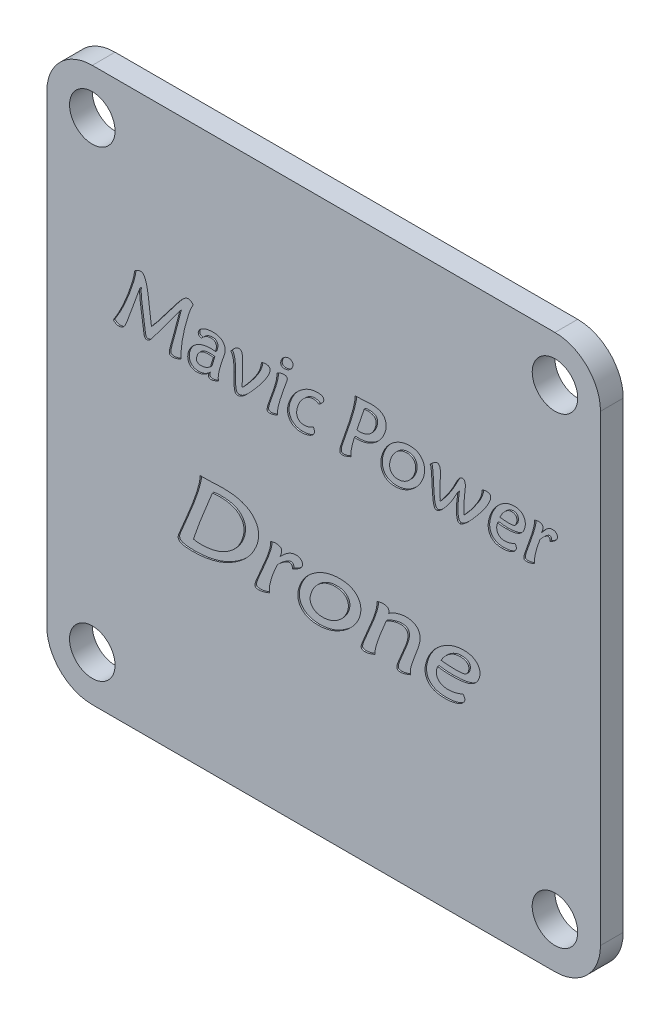
from build123d import *

# Parameters (mm, degrees)
SKETCH_1_R          = 1.5
EXTRUDE_1_DEPTH     = 1.5
CUT_EXTRUDE_2_DEPTH = 0.1
CUT_EXTRUDE_3_DEPTH = 0.1


with BuildPart() as part:
    # 草图1 → 凸台-拉伸1 (new body)
    with BuildSketch(Plane.XY):
        with BuildLine():
            Line((-15.25, 18.25), (15.25, 18.25))
            ThreePointArc((15.25, 18.25), (17.371320344, 17.371320344), (18.25, 15.25))
            Line((18.25, 15.25), (18.25, -15.25))
            ThreePointArc((18.25, -15.25), (17.371320344, -17.371320344), (15.25, -18.25))
            Line((15.25, -18.25), (-15.25, -18.25))
            ThreePointArc((-15.25, -18.25), (-17.371320344, -17.371320344), (-18.25, -15.25))
            Line((-18.25, -15.25), (-18.25, 15.25))
            ThreePointArc((-18.25, 15.25), (-17.371320344, 17.371320344), (-15.25, 18.25))
        make_face()
        with Locations((-15.25, 15.25)):
            Circle(SKETCH_1_R, mode=Mode.SUBTRACT)
        with Locations(Location((15.25, 15.25, 0), (0, 0, 180))):
            Circle(SKETCH_1_R, mode=Mode.SUBTRACT)
        with Locations((15.25, -15.25)):
            Circle(SKETCH_1_R, mode=Mode.SUBTRACT)
        with Locations(Location((-15.25, -15.25, 0), (0, 0, 180))):
            Circle(SKETCH_1_R, mode=Mode.SUBTRACT)
    extrude(amount=EXTRUDE_1_DEPTH)

    # 草图3 → 切除-拉伸2 (cut)
    # profile 1 of 11: a face of its own
    with BuildSketch(Plane.XY.offset(1.5)):
        with BuildLine():
            add(Edge.make_bspline(
                [(-8.599528558, 7.900380316), (-8.629326501, 7.84700145), (-8.690751315, 7.736967446), (-8.76981754, 7.558420171), (-8.847891215, 7.366002274), (-8.891797769, 7.230153613), (-8.914432212, 7.160121728)],
                knots=[0, 0, 0, 0, 0.909691944, 1.875218693, 2.904645514, 4, 4, 4, 4], degree=3))
            add(Edge.make_bspline(
                [(-8.914432212, 7.160121728), (-8.935972424, 7.090182953), (-8.97850074, 6.952098036), (-9.039125616, 6.747336754), (-9.093499033, 6.547289941), (-9.144891947, 6.352933989), (-9.191080461, 6.163323191), (-9.232580194, 5.978680333), (-9.269464585, 5.799274267), (-9.301714222, 5.625098099), (-9.329217645, 5.456122509), (-9.351697177, 5.292042466), (-9.371146968, 5.133363198), (-9.383959271, 4.979416041), (-9.393785444, 4.83083499), (-9.398413284, 4.687150995), (-9.398826843, 4.548666245), (-9.394952921, 4.458104642), (-9.393054431, 4.4137232)],
                knots=[0, 0, 0, 0, 1.253907898, 2.475676274, 3.658756811, 4.805791586, 5.920218179, 7.002385872, 8.048293078, 9.058322644, 10.037315851, 10.981345001, 11.895896731, 12.776097226, 13.627855053, 14.447040947, 15.238942763, 16, 16, 16, 16], degree=3))
            add(Edge.make_bspline(
                [(-9.393054431, 4.4137232), (-9.419557105, 4.399878471), (-9.471233094, 4.372883457), (-9.548551574, 4.33805281), (-9.622371187, 4.307873056), (-9.692961621, 4.283508271), (-9.760406332, 4.264378474), (-9.824863525, 4.25136544), (-9.886007454, 4.241676566), (-9.925953486, 4.240954452), (-9.945310838, 4.240604524)],
                knots=[0, 0, 0, 0, 1.228304328, 2.394997627, 3.482760729, 4.503996059, 5.461898789, 6.360340043, 7.205441127, 8, 8, 8, 8], degree=3))
            add(Edge.make_bspline(
                [(-9.945310838, 4.240604524), (-9.963873492, 4.241296958), (-9.998829283, 4.242600898), (-10.047550807, 4.249688909), (-10.088881345, 4.263543758), (-10.121582795, 4.284564894), (-10.148006908, 4.30971953), (-10.164971826, 4.342120366), (-10.173316439, 4.379829326), (-10.173346651, 4.424656941), (-10.165702892, 4.479470727), (-10.153863097, 4.54842273), (-10.136543235, 4.633110695), (-10.112514173, 4.733476765), (-10.083615436, 4.8499601), (-10.049221363, 4.982445764), (-10.008178874, 5.130350181), (-9.961936226, 5.293988242), (-9.910865693, 5.47232759), (-9.857737079, 5.665666762), (-9.801324171, 5.87265823), (-9.742635209, 6.094171484), (-9.680743449, 6.329366485), (-9.616571069, 6.57907661), (-9.549174456, 6.842468032), (-9.503948115, 7.023016592), (-9.480788782, 7.11547121)],
                knots=[0, 0, 0, 0, 0.428685551, 0.807268301, 1.133296604, 1.425962528, 1.698770681, 1.965789499, 2.256774316, 2.582356464, 2.995105597, 3.533244367, 4.197667524, 4.990195309, 5.915686224, 6.968425748, 8.150104174, 9.459251357, 10.894257126, 12.432823532, 14.088227376, 15.847293417, 17.723256309, 19.702951902, 21.799584015, 24, 24, 24, 24], degree=3))
            add(Edge.make_bspline(
                [(-9.480788782, 7.11547121), (-9.541379771, 7.030357143), (-9.660378845, 6.863195402), (-9.835566571, 6.616648066), (-10.006919515, 6.380613402), (-10.170613326, 6.152216717), (-10.331032988, 5.934561117), (-10.485343507, 5.725404852), (-10.633493377, 5.524875293), (-10.754821259, 5.365200969), (-10.846287757, 5.24246683), (-10.911347786, 5.157310652), (-10.97291545, 5.077045533), (-11.030092558, 5.001438073), (-11.084940122, 4.931549636), (-11.134602106, 4.865909641), (-11.180730887, 4.805319078), (-11.224137927, 4.750678505), (-11.263216784, 4.700271199), (-11.299003256, 4.655105708), (-11.331451042, 4.615160803), (-11.359262952, 4.579640915), (-11.384571314, 4.550021346), (-11.405793503, 4.525023277), (-11.422666976, 4.504359437), (-11.448889667, 4.476905932), (-11.487173055, 4.443496442), (-11.545243261, 4.412434377), (-11.608915535, 4.392751904), (-11.653634879, 4.390560127), (-11.676497589, 4.389439585)],
                knots=[0, 0, 0, 0, 2.477851627, 4.866434049, 7.172977785, 9.395292326, 11.530649649, 13.585448652, 15.559704411, 17.443525636, 18.341466288, 19.189887988, 19.985064642, 20.740598708, 21.437985159, 22.091952427, 22.69267568, 23.243964604, 23.746908978, 24.205335685, 24.610566966, 24.967440276, 25.27508694, 25.534367878, 25.745283441, 25.907361757, 26.434650664, 26.94173363, 27.458962631, 28, 28, 28, 28], degree=3))
            add(Edge.make_bspline(
                [(-11.676497589, 4.389439585), (-11.689757518, 4.390397065), (-11.715235021, 4.392236759), (-11.75047645, 4.40966138), (-11.780094529, 4.437110887), (-11.799367329, 4.469927629), (-11.811994234, 4.506085559), (-11.82382485, 4.545953822), (-11.834951593, 4.598709987), (-11.847372734, 4.663490254), (-11.860841555, 4.740211321), (-11.873643918, 4.829416439), (-11.888972606, 4.930593981), (-11.898084018, 5.002513036), (-11.902883548, 5.040397137)],
                knots=[0, 0, 0, 0, 0.645638929, 1.240524477, 1.883116725, 2.600275167, 3.07773427, 3.757549468, 4.635559705, 5.716510455, 6.98845681, 8.449769389, 10.129879582, 12, 12, 12, 12], degree=3))
            Line((-11.902883548, 5.040397137), (-12.062685402, 6.155093402))
            add(Edge.make_bspline(
                [(-12.062685402, 6.155093402), (-12.070503228, 6.206498903), (-12.085601349, 6.305775405), (-12.103471565, 6.449964969), (-12.117412535, 6.583902716), (-12.124724623, 6.707794134), (-12.129533169, 6.821426605), (-12.127689623, 6.925199042), (-12.122302069, 7.018927264), (-12.113723339, 7.07765081), (-12.109685948, 7.105287759)],
                knots=[0, 0, 0, 0, 1.306793744, 2.523735983, 3.651497249, 4.690485513, 5.642648951, 6.509030564, 7.298307946, 8, 8, 8, 8], degree=3))
            add(Edge.make_bspline(
                [(-12.109685948, 7.105287759), (-12.151389171, 6.989325984), (-12.233315789, 6.761517308), (-12.355403286, 6.426060472), (-12.47130575, 6.101890543), (-12.566731452, 5.840673209), (-12.638048767, 5.640034736), (-12.689017534, 5.499832824), (-12.737440363, 5.3685341), (-12.78349526, 5.245779575), (-12.824982765, 5.131012025), (-12.865437183, 5.02528558), (-12.90188121, 4.927907466), (-12.936678557, 4.839618471), (-12.967687196, 4.759115383), (-12.997455627, 4.68777608), (-13.024179933, 4.624506394), (-13.048316399, 4.569866852), (-13.069910433, 4.523432956), (-13.090075573, 4.486030082), (-13.105333361, 4.455665154), (-13.135100256, 4.416406511), (-13.183630058, 4.365381165), (-13.242268052, 4.311043721), (-13.302696212, 4.273389588), (-13.361501537, 4.25388431), (-13.431775921, 4.242402333), (-13.482310971, 4.241233708), (-13.509518854, 4.240604524)],
                knots=[0, 0, 0, 0, 2.902647681, 5.702295639, 8.408424222, 11.011551493, 12.252701664, 13.423949888, 14.525324483, 15.548945046, 16.512116549, 17.399685393, 18.215272409, 18.961088298, 19.634936557, 20.247134852, 20.781754717, 21.252607322, 21.654267369, 21.987125218, 22.254151983, 22.452208207, 23.144360583, 23.911552314, 24.328189612, 24.810589591, 25.359625855, 26, 26, 26, 26], degree=3))
            add(Edge.make_bspline(
                [(-13.509518854, 4.240604524), (-13.521308429, 4.241048457), (-13.546171132, 4.241984654), (-13.584428904, 4.250575196), (-13.625271941, 4.263157453), (-13.66880546, 4.280636739), (-13.71482823, 4.303711968), (-13.764046251, 4.331017001), (-13.816130087, 4.363351647), (-13.850913443, 4.387696497), (-13.869073026, 4.400406378)],
                knots=[0, 0, 0, 0, 0.708646398, 1.494444463, 2.349314244, 3.280091566, 4.313082454, 5.445496069, 6.666352787, 8, 8, 8, 8], degree=3))
            add(Edge.make_bspline(
                [(-13.869073026, 4.400406378), (-13.808944961, 4.494145592), (-13.686486233, 4.685057853), (-13.515530742, 4.986889459), (-13.350361513, 5.306954595), (-13.1907203, 5.644939933), (-13.038113328, 6.001621697), (-12.890887905, 6.376161755), (-12.74969951, 6.769289252), (-12.662982325, 7.039223061), (-12.618858521, 7.176571919)],
                knots=[0, 0, 0, 0, 0.874953602, 1.78195831, 2.724399287, 3.704620846, 4.718412543, 5.772286842, 6.866485608, 8, 8, 8, 8], degree=3))
            add(Edge.make_bspline(
                [(-12.618858521, 7.176571919), (-12.598340605, 7.244535651), (-12.559039757, 7.374716137), (-12.513163159, 7.564950351), (-12.481659037, 7.741320668), (-12.471128499, 7.854855278), (-12.466106749, 7.908997083)],
                knots=[0, 0, 0, 0, 1.13596322, 2.175869962, 3.130118199, 4, 4, 4, 4], degree=3))
            add(Edge.make_bspline(
                [(-12.466106749, 7.908997083), (-12.428690407, 7.936251749), (-12.357895348, 7.98782001), (-12.245901246, 8.043958867), (-12.137581028, 8.080803786), (-12.06529319, 8.085394107), (-12.030568363, 8.087599155)],
                knots=[0, 0, 0, 0, 1.158211745, 2.191439987, 3.131224081, 4, 4, 4, 4], degree=3))
            add(Edge.make_bspline(
                [(-12.030568363, 8.087599155), (-12.017371243, 8.08671387), (-11.990739756, 8.084927387), (-11.952301868, 8.069321655), (-11.914865979, 8.046450342), (-11.879502349, 8.013140348), (-11.844981208, 7.971363339), (-11.812502802, 7.920029379), (-11.781016962, 7.860067049), (-11.751689004, 7.790655801), (-11.72254914, 7.712360306), (-11.695751605, 7.624520364), (-11.668690377, 7.527778582), (-11.644050984, 7.421587434), (-11.620830392, 7.306297224), (-11.597798827, 7.182080513), (-11.576870221, 7.048574268), (-11.564553845, 6.95621767), (-11.558212883, 6.908668811)],
                knots=[0, 0, 0, 0, 0.472705532, 0.953908991, 1.472310169, 2.043747709, 2.690345428, 3.4167745, 4.22294428, 5.122704013, 6.12357291, 7.225029181, 8.422899879, 9.73436265, 11.142659347, 12.650543551, 14.275566248, 16, 16, 16, 16], degree=3))
            add(Edge.make_bspline(
                [(-11.558212883, 6.908668811), (-11.55022014, 6.843377431), (-11.534742284, 6.716941413), (-11.51066783, 6.534038812), (-11.49011222, 6.363390055), (-11.469140414, 6.205819767), (-11.4517262, 6.060236651), (-11.433918265, 5.927729791), (-11.419550277, 5.807485262), (-11.405301233, 5.70021934), (-11.392371008, 5.605519557), (-11.38286708, 5.523374705), (-11.372965775, 5.45401636), (-11.365573701, 5.397298958), (-11.358677934, 5.353018216), (-11.35524675, 5.321310866), (-11.352528984, 5.30216969), (-11.350386198, 5.293934587), (-11.349843799, 5.291850054)],
                knots=[0, 0, 0, 0, 1.936720601, 3.750437551, 5.431598217, 6.997385965, 8.430616046, 9.748475129, 10.933774646, 11.996083015, 12.934428839, 13.747832584, 14.430638016, 14.99710348, 15.432002577, 15.749545933, 15.936603107, 16, 16, 16, 16], degree=3))
            add(Edge.make_bspline(
                [(-11.349843799, 5.291850054), (-11.348856551, 5.294233244), (-11.344360908, 5.305085604), (-11.325590878, 5.325568046), (-11.296854005, 5.361904017), (-11.253847264, 5.411868238), (-11.199436454, 5.476696945), (-11.133055856, 5.555748326), (-11.054436375, 5.647975289), (-10.998843039, 5.714539792), (-10.969139382, 5.75010537)],
                knots=[0, 0, 0, 0, 0.103539939, 0.471491021, 1.09875022, 1.979075135, 3.120534678, 4.508315542, 6.134384415, 8, 8, 8, 8], degree=3))
            Line((-10.969139382, 5.75010537), (-9.694641263, 7.414708015))
            add(Edge.make_bspline(
                [(-9.694641263, 7.414708015), (-9.654296476, 7.466722975), (-9.577719918, 7.565450146), (-9.46346839, 7.700278306), (-9.359326374, 7.816643703), (-9.263175083, 7.913033851), (-9.173499055, 7.990104468), (-9.087270407, 8.044605179), (-9.00454999, 8.080155724), (-8.949187287, 8.085211961), (-8.923048978, 8.087599155)],
                knots=[0, 0, 0, 0, 1.50493228, 2.856441775, 4.039969883, 5.074273531, 5.968637831, 6.735647991, 7.403063413, 8, 8, 8, 8], degree=3))
            add(Edge.make_bspline(
                [(-8.923048978, 8.087599155), (-8.908130235, 8.086933915), (-8.878567144, 8.085615671), (-8.834925472, 8.076953312), (-8.792842947, 8.061364403), (-8.751437359, 8.041205444), (-8.711028371, 8.015110091), (-8.672494485, 7.982378921), (-8.634923547, 7.9439221), (-8.611574952, 7.915199405), (-8.599528558, 7.900380316)],
                knots=[0, 0, 0, 0, 0.923655934, 1.830323314, 2.740442486, 3.694709744, 4.676642652, 5.709416261, 6.818204079, 8, 8, 8, 8], degree=3))
        make_face()
    # profile 2 of 11: a face of its own
    with BuildSketch(Plane.XY.offset(1.5)):
        with BuildLine():
            add(Edge.make_bspline(
                [(-6.921609092, 4.402756406), (-6.947430833, 4.389131376), (-6.997003825, 4.362973826), (-7.068954152, 4.326000015), (-7.137236037, 4.297053794), (-7.199659194, 4.270987555), (-7.258060668, 4.252622968), (-7.311128136, 4.237720168), (-7.360047646, 4.22978217), (-7.391071265, 4.228087571), (-7.405714708, 4.227287703)],
                knots=[0, 0, 0, 0, 1.349605386, 2.590994088, 3.736769874, 4.776651576, 5.715540929, 6.564486408, 7.322423931, 8, 8, 8, 8], degree=3))
            add(Edge.make_bspline(
                [(-7.405714708, 4.227287703), (-7.42435555, 4.228083374), (-7.458808389, 4.229553969), (-7.506014272, 4.242795779), (-7.544215387, 4.26556128), (-7.569972145, 4.300223301), (-7.587251218, 4.342420738), (-7.59111365, 4.394162975), (-7.587203739, 4.454090212), (-7.577180167, 4.496081984), (-7.571783302, 4.518691084)],
                knots=[0, 0, 0, 0, 1.088768414, 2.012310662, 2.843227565, 3.637950169, 4.49487407, 5.478645484, 6.642458913, 8, 8, 8, 8], degree=3))
            add(Edge.make_bspline(
                [(-7.571783302, 4.518691084), (-7.600562881, 4.492540727), (-7.657152585, 4.441120899), (-7.748418809, 4.374995489), (-7.841137937, 4.317868019), (-7.936363586, 4.271384413), (-8.033960522, 4.235132761), (-8.133625277, 4.209053362), (-8.235857683, 4.19394269), (-8.304682098, 4.191636115), (-8.339458875, 4.19047061)],
                knots=[0, 0, 0, 0, 1.089741352, 2.142774254, 3.154968326, 4.140701192, 5.109148303, 6.069980451, 7.024766752, 8, 8, 8, 8], degree=3))
            add(Edge.make_bspline(
                [(-8.339458875, 4.19047061), (-8.369788901, 4.191164088), (-8.428343123, 4.192502896), (-8.512655265, 4.204377775), (-8.590014536, 4.22373935), (-8.660474685, 4.251127863), (-8.723891396, 4.286888739), (-8.780886707, 4.329842896), (-8.829906665, 4.381933578), (-8.872185452, 4.440589883), (-8.906457677, 4.505177268), (-8.93161013, 4.574388048), (-8.948767843, 4.646936557), (-8.958603212, 4.723370819), (-8.957768486, 4.80376257), (-8.950071999, 4.887678296), (-8.933455938, 4.975275849), (-8.91625438, 5.033741757), (-8.90738213, 5.063897409)],
                knots=[0, 0, 0, 0, 1.155800062, 2.231352289, 3.238140794, 4.190141472, 5.103847761, 6.005765206, 6.899958723, 7.819933711, 8.75507884, 9.677850111, 10.619489565, 11.592441863, 12.607806026, 13.677584488, 14.802140338, 16, 16, 16, 16], degree=3))
            add(Edge.make_bspline(
                [(-8.90738213, 5.063897409), (-8.895452816, 5.098598259), (-8.871819754, 5.167343818), (-8.825968953, 5.265755654), (-8.771685201, 5.358406904), (-8.709356572, 5.446016893), (-8.638712671, 5.528479192), (-8.559192973, 5.605487188), (-8.471153995, 5.676702965), (-8.375708729, 5.742250623), (-8.27441332, 5.801462387), (-8.168200638, 5.853553718), (-8.05778576, 5.897030425), (-7.943619181, 5.933787211), (-7.824977932, 5.960465984), (-7.702690886, 5.981333467), (-7.576191038, 5.99303753), (-7.490599332, 5.994533548), (-7.447231857, 5.995291548)],
                knots=[0, 0, 0, 0, 0.948923833, 1.879904949, 2.803403834, 3.723858087, 4.658167118, 5.608941011, 6.583890979, 7.584600741, 8.601956971, 9.617179881, 10.642157031, 11.669891413, 12.717093649, 13.785567836, 14.877994906, 16, 16, 16, 16], degree=3))
            add(Edge.make_bspline(
                [(-7.447231857, 5.995291548), (-7.41693634, 5.994723447), (-7.358905964, 5.993635262), (-7.276198975, 5.988701805), (-7.201794571, 5.97877692), (-7.155765404, 5.968200052), (-7.133894888, 5.963174509)],
                knots=[0, 0, 0, 0, 1.151546088, 2.205760446, 3.147476565, 4, 4, 4, 4], degree=3))
            add(Edge.make_bspline(
                [(-7.133894888, 5.963174509), (-7.133090852, 5.965256288), (-7.130709322, 5.971422449), (-7.127127438, 5.983812593), (-7.121434461, 6.002362723), (-7.11693292, 6.016705602), (-7.114311328, 6.02505856)],
                knots=[0, 0, 0, 0, 0.412381276, 1.221459789, 2.381842974, 4, 4, 4, 4], degree=3))
            add(Edge.make_bspline(
                [(-7.114311328, 6.02505856), (-7.107802945, 6.047450024), (-7.095246148, 6.09065047), (-7.08104967, 6.153895724), (-7.071985087, 6.213313903), (-7.069014698, 6.268643366), (-7.070131487, 6.320095269), (-7.076960345, 6.367285477), (-7.089723781, 6.410512871), (-7.107608821, 6.449591062), (-7.130451818, 6.484622456), (-7.158523719, 6.514684583), (-7.19055134, 6.541021024), (-7.228561062, 6.561300578), (-7.270510521, 6.577919185), (-7.317844365, 6.588408184), (-7.369190597, 6.595718438), (-7.405163454, 6.596496774), (-7.423731584, 6.596898527)],
                knots=[0, 0, 0, 0, 1.39619845, 2.693722686, 3.879071904, 4.991085208, 6.007994813, 6.956733074, 7.837437331, 8.698060717, 9.5221067, 10.32996984, 11.152976578, 11.992893663, 12.898916568, 13.84713921, 14.888756598, 16, 16, 16, 16], degree=3))
            add(Edge.make_bspline(
                [(-7.423731584, 6.596898527), (-7.452272532, 6.596139012), (-7.50927288, 6.59462215), (-7.593295659, 6.57786941), (-7.675432451, 6.552990973), (-7.755299649, 6.517428757), (-7.832026958, 6.470574172), (-7.906941877, 6.414362662), (-7.980170096, 6.348571768), (-8.025020722, 6.298375168), (-8.048055494, 6.272594765)],
                knots=[0, 0, 0, 0, 0.941045088, 1.87940147, 2.817401417, 3.770568768, 4.756652573, 5.779032394, 6.859336266, 8, 8, 8, 8], degree=3))
            add(Edge.make_bspline(
                [(-8.048055494, 6.272594765), (-8.069154626, 6.277682271), (-8.108586209, 6.287190169), (-8.161067561, 6.310296501), (-8.203686862, 6.337343915), (-8.235755414, 6.370475271), (-8.256890937, 6.409135021), (-8.266300837, 6.453068299), (-8.2641311, 6.501548058), (-8.255529977, 6.534098591), (-8.250941181, 6.551464667)],
                knots=[0, 0, 0, 0, 1.291966595, 2.41452052, 3.403526234, 4.284659338, 5.134698601, 5.996072221, 6.930881996, 8, 8, 8, 8], degree=3))
            add(Edge.make_bspline(
                [(-8.250941181, 6.551464667), (-8.244874568, 6.568377265), (-8.232761938, 6.602145046), (-8.206110512, 6.649556296), (-8.17374541, 6.694424954), (-8.13523819, 6.737171183), (-8.089178125, 6.776128168), (-8.037248574, 6.812994085), (-7.979192718, 6.847519995), (-7.891821652, 6.889751993), (-7.771337391, 6.933089242), (-7.6153286, 6.972065807), (-7.445986752, 6.993301756), (-7.329002157, 6.996380827), (-7.268629785, 6.997969847)],
                knots=[0, 0, 0, 0, 0.564274581, 1.12663352, 1.703263139, 2.302097644, 2.930981531, 3.596393873, 4.303429327, 5.05270136, 6.645432509, 8.320553766, 10.101144024, 12, 12, 12, 12], degree=3))
            add(Edge.make_bspline(
                [(-7.268629785, 6.997969847), (-7.231004194, 6.997233938), (-7.158168437, 6.995809364), (-7.053168467, 6.984479499), (-6.957083724, 6.963765386), (-6.869198604, 6.936964473), (-6.790426651, 6.900865319), (-6.720238704, 6.856420141), (-6.658946931, 6.803952121), (-6.606955771, 6.743678325), (-6.563800352, 6.678171715), (-6.530864028, 6.60783059), (-6.506923173, 6.533927183), (-6.492810071, 6.456225699), (-6.489245344, 6.374366012), (-6.495026228, 6.289073463), (-6.509733344, 6.199692272), (-6.527192259, 6.14031192), (-6.536204621, 6.109659541)],
                knots=[0, 0, 0, 0, 1.292065257, 2.50118468, 3.619759685, 4.663436053, 5.650487857, 6.585839174, 7.507899701, 8.410525837, 9.310877398, 10.193368076, 11.069640735, 11.971955014, 12.896671589, 13.876117678, 14.903643341, 16, 16, 16, 16], degree=3))
            Line((-6.536204621, 6.109659541), (-6.754757156, 5.464968729))
            add(Edge.make_bspline(
                [(-6.754757156, 5.464968729), (-6.775190606, 5.398221727), (-6.813925525, 5.271691955), (-6.863888854, 5.090604096), (-6.901378824, 4.928752983), (-6.929142322, 4.786277245), (-6.94454907, 4.662883354), (-6.948847223, 4.558757686), (-6.944961998, 4.472675087), (-6.928785042, 4.424241226), (-6.921609092, 4.402756406)],
                knots=[0, 0, 0, 0, 1.539215568, 2.917832853, 4.141310541, 5.201690385, 6.117968841, 6.87853679, 7.502529131, 8, 8, 8, 8], degree=3))
        make_face()
        with BuildLine():
            add(Edge.make_bspline(
                [(-7.267846442, 5.565236559), (-7.319693866, 5.573787376), (-7.424224175, 5.591026797), (-7.530148151, 5.593150094), (-7.583533438, 5.594220228)],
                knots=[0, 0, 0, 0, 0.992007481, 2, 2, 2, 2], degree=3))
            add(Edge.make_bspline(
                [(-7.583533438, 5.594220228), (-7.631669248, 5.593048198), (-7.724050458, 5.590798863), (-7.855808841, 5.568786849), (-7.974078285, 5.532389737), (-8.078704381, 5.480147694), (-8.170099881, 5.411920653), (-8.246487501, 5.325212695), (-8.30855391, 5.220628732), (-8.336603311, 5.142289918), (-8.351209011, 5.101497845)],
                knots=[0, 0, 0, 0, 1.167909224, 2.241426237, 3.231930282, 4.161888045, 5.06720838, 5.983297259, 6.949875779, 8, 8, 8, 8], degree=3))
            add(Edge.make_bspline(
                [(-8.351209011, 5.101497845), (-8.360487486, 5.068833938), (-8.377509797, 5.008908654), (-8.384537579, 4.922495146), (-8.375513746, 4.848606051), (-8.344953844, 4.788669692), (-8.297932019, 4.744172787), (-8.237727702, 4.713691269), (-8.165389685, 4.694613817), (-8.112945993, 4.692787433), (-8.084872588, 4.691809759)],
                knots=[0, 0, 0, 0, 1.340513073, 2.459308483, 3.410482086, 4.246775702, 5.065072694, 5.929233638, 6.891507013, 8, 8, 8, 8], degree=3))
            add(Edge.make_bspline(
                [(-8.084872588, 4.691809759), (-8.056888294, 4.692545398), (-8.000935563, 4.694016259), (-7.91816086, 4.706424038), (-7.83660379, 4.724773149), (-7.757651533, 4.752689625), (-7.680063037, 4.787475703), (-7.604186239, 4.829715696), (-7.530027423, 4.880117165), (-7.48347716, 4.918838637), (-7.459765336, 4.938562622)],
                knots=[0, 0, 0, 0, 0.977060106, 1.953566553, 2.918243394, 3.893257655, 4.873123823, 5.885769055, 6.923050732, 8, 8, 8, 8], degree=3))
            add(Edge.make_bspline(
                [(-7.459765336, 4.938562622), (-7.43151201, 5.041744775), (-7.373790007, 5.252547593), (-7.303653214, 5.459554044), (-7.267846442, 5.565236559)],
                knots=[0, 0, 0, 0, 0.978944724, 2, 2, 2, 2], degree=3))
        make_face(mode=Mode.SUBTRACT)
    # profile 3 of 11: a face of its own
    with BuildSketch(Plane.XY.offset(1.5)):
        with BuildLine():
            add(Edge.make_bspline(
                [(-6.116333083, 6.509164176), (-6.089228603, 6.541814257), (-6.037807102, 6.603756643), (-5.960008739, 6.687532879), (-5.888088506, 6.759136369), (-5.821775645, 6.818513801), (-5.759942378, 6.864894687), (-5.702516155, 6.897132502), (-5.650494861, 6.919227776), (-5.616465353, 6.922194687), (-5.60089377, 6.923552317)],
                knots=[0, 0, 0, 0, 1.506459189, 2.857992175, 4.057739412, 5.108729805, 6.017378206, 6.793636389, 7.447979378, 8, 8, 8, 8], degree=3))
            add(Edge.make_bspline(
                [(-5.60089377, 6.923552317), (-5.585712752, 6.922972848), (-5.556596555, 6.921861464), (-5.515093921, 6.912838537), (-5.479213786, 6.895481295), (-5.446794562, 6.873624534), (-5.42035044, 6.843868059), (-5.397755616, 6.808595435), (-5.380852012, 6.766560973), (-5.36857241, 6.717743174), (-5.359474811, 6.66080902), (-5.351824445, 6.594412437), (-5.345757498, 6.517851898), (-5.341075526, 6.430874041), (-5.338179145, 6.333714896), (-5.336367039, 6.22612061), (-5.337715806, 6.108349888), (-5.338728477, 6.02636343), (-5.339257401, 5.983541412)],
                knots=[0, 0, 0, 0, 0.676503653, 1.297489623, 1.875330595, 2.443483094, 3.028195741, 3.63506655, 4.302806962, 5.036627042, 5.874515439, 6.87041516, 8.014557656, 9.296444174, 10.751715774, 12.346047308, 14.091518581, 16, 16, 16, 16], degree=3))
            add(Edge.make_bspline(
                [(-5.339257401, 5.983541412), (-5.34029531, 5.936018506), (-5.342302729, 5.844104508), (-5.345317722, 5.710933247), (-5.348848926, 5.587180727), (-5.350617758, 5.472524819), (-5.354086705, 5.367048897), (-5.357000921, 5.270690716), (-5.360561935, 5.183501141), (-5.362358641, 5.10539192), (-5.365570777, 5.036460248), (-5.36920459, 4.976717932), (-5.370595531, 4.926202968), (-5.374741776, 4.885128098), (-5.375760686, 4.852653958), (-5.380264157, 4.830257205), (-5.380393707, 4.815212958), (-5.384318252, 4.810049247), (-5.385474604, 4.80852778)],
                knots=[0, 0, 0, 0, 1.938337039, 3.748935516, 5.431800445, 6.986682898, 8.424744083, 9.735095194, 10.917749521, 11.982991781, 12.920950885, 13.731290964, 14.424123811, 14.979436369, 15.417156374, 15.739412201, 15.923218832, 16, 16, 16, 16], degree=3))
            add(Edge.make_bspline(
                [(-5.385474604, 4.80852778), (-5.382012999, 4.809130164), (-5.373208822, 4.810662257), (-5.359820735, 4.819663959), (-5.342010725, 4.831351776), (-5.321102209, 4.848535336), (-5.298132989, 4.871848991), (-5.270115103, 4.898399609), (-5.238932983, 4.930448536), (-5.205032715, 4.968057004), (-5.166843009, 5.009574813), (-5.12650773, 5.056899909), (-5.08177844, 5.10830512), (-5.033793205, 5.164807892), (-4.983193898, 5.226912237), (-4.928286506, 5.293220713), (-4.870137191, 5.364624977), (-4.790106045, 5.465577375), (-4.691132116, 5.591176223), (-4.582597829, 5.74109312), (-4.483881261, 5.88454353), (-4.397178983, 6.022820902), (-4.321249782, 6.155279727), (-4.258114654, 6.282388111), (-4.204061555, 6.403101388), (-4.177211223, 6.483602656), (-4.16424377, 6.522480997)],
                knots=[0, 0, 0, 0, 0.117996372, 0.300109636, 0.535604679, 0.843631868, 1.212658779, 1.644215962, 2.150811974, 2.726704683, 3.359111508, 4.061321095, 4.832594331, 5.667189014, 6.571981566, 7.545848288, 8.583186845, 9.690938588, 11.909405772, 13.998622691, 15.95864631, 17.806428497, 19.525414676, 21.127289858, 22.612615587, 24, 24, 24, 24], degree=3))
            add(Edge.make_bspline(
                [(-4.16424377, 6.522480997), (-4.155770977, 6.551104057), (-4.138806275, 6.608414752), (-4.120198723, 6.696102504), (-4.107394857, 6.785366014), (-4.103528293, 6.845441275), (-4.101576376, 6.875768429)],
                knots=[0, 0, 0, 0, 0.995288278, 1.992822013, 2.986737689, 4, 4, 4, 4], degree=3))
            add(Edge.make_bspline(
                [(-4.101576376, 6.875768429), (-4.072659464, 6.883115498), (-4.018473712, 6.896882752), (-3.942116049, 6.911682744), (-3.876463972, 6.921109426), (-3.836307954, 6.922787512), (-3.81800642, 6.923552317)],
                knots=[0, 0, 0, 0, 1.242034994, 2.327378539, 3.237684916, 4, 4, 4, 4], degree=3))
            add(Edge.make_bspline(
                [(-3.81800642, 6.923552317), (-3.788927378, 6.923009761), (-3.735475366, 6.922012455), (-3.662516869, 6.906195595), (-3.603664775, 6.881772839), (-3.558037969, 6.846506537), (-3.530222741, 6.79786437), (-3.519387981, 6.740003313), (-3.522093529, 6.673020868), (-3.535168882, 6.627243076), (-3.542269887, 6.602381924)],
                knots=[0, 0, 0, 0, 1.316958936, 2.420784857, 3.365074307, 4.190306395, 4.986804831, 5.846523064, 6.83048275, 8, 8, 8, 8], degree=3))
            add(Edge.make_bspline(
                [(-3.542269887, 6.602381924), (-3.548580715, 6.583242017), (-3.561862616, 6.54295976), (-3.58733787, 6.48112548), (-3.617948166, 6.41490511), (-3.653105388, 6.344164526), (-3.694342719, 6.26986039), (-3.739683016, 6.190520193), (-3.790488918, 6.106850374), (-3.847164772, 6.019440398), (-3.90781646, 5.927358447), (-3.975761715, 5.833049566), (-4.047532092, 5.734388593), (-4.124489497, 5.632008695), (-4.207742506, 5.526821189), (-4.295146918, 5.416928686), (-4.388505286, 5.304217337), (-4.485807409, 5.189976271), (-4.583986067, 5.077623359), (-4.678721544, 4.969015967), (-4.769876084, 4.867464894), (-4.858039594, 4.773318808), (-4.941874047, 4.685595453), (-5.021436652, 4.603763451), (-5.09823481, 4.529874937), (-5.170395653, 4.461731682), (-5.239623833, 4.40117033), (-5.307655126, 4.349262376), (-5.372964615, 4.304011799), (-5.437474181, 4.268184512), (-5.49945504, 4.238989107), (-5.5604179, 4.219810265), (-5.619333424, 4.205933994), (-5.658525257, 4.20449167), (-5.677661327, 4.203787431)],
                knots=[0, 0, 0, 0, 0.588185886, 1.237908516, 1.950786038, 2.717807825, 3.543352684, 4.431162788, 5.385496148, 6.400435416, 7.472316156, 8.603899171, 9.793141808, 11.034124989, 12.342505078, 13.709164009, 15.133145128, 16.614779898, 18.08983112, 19.488865735, 20.822058119, 22.073299846, 23.254034912, 24.364443659, 25.404854707, 26.364833802, 27.261921851, 28.088275741, 28.862085464, 29.578783668, 30.240557274, 30.857668438, 31.442237429, 32, 32, 32, 32], degree=3))
            add(Edge.make_bspline(
                [(-5.677661327, 4.203787431), (-5.690294567, 4.204500825), (-5.715096875, 4.205901404), (-5.750308389, 4.218182147), (-5.782044566, 4.238262701), (-5.808420735, 4.267621381), (-5.832392304, 4.303279241), (-5.851669399, 4.347443978), (-5.867856901, 4.398905751), (-5.880414786, 4.45927065), (-5.889301656, 4.530285565), (-5.89696834, 4.613636337), (-5.903064004, 4.710551525), (-5.907853072, 4.820756398), (-5.909808627, 4.944822156), (-5.910538427, 5.082173843), (-5.909951826, 5.233115251), (-5.907617064, 5.338069819), (-5.906397314, 5.392901226)],
                knots=[0, 0, 0, 0, 0.468323074, 0.919439036, 1.368986622, 1.849517217, 2.374353373, 2.960636295, 3.632754518, 4.376948923, 5.248440105, 6.291316894, 7.487458454, 8.856992309, 10.390536057, 12.098507044, 13.961743316, 16, 16, 16, 16], degree=3))
            add(Edge.make_bspline(
                [(-5.906397314, 5.392901226), (-5.905503193, 5.460798372), (-5.903796901, 5.590369577), (-5.911250778, 5.775645302), (-5.924094392, 5.94293984), (-5.947120342, 6.091963391), (-5.97537539, 6.223604563), (-6.014265389, 6.336149412), (-6.057792071, 6.432432273), (-6.097647365, 6.484672103), (-6.116333083, 6.509164176)],
                knots=[0, 0, 0, 0, 1.409712334, 2.690218032, 3.849205596, 4.891302878, 5.819910365, 6.639501102, 7.36214497, 8, 8, 8, 8], degree=3))
        make_face()
    # profile 4 of 11: a face of its own
    with BuildSketch(Plane.XY.offset(1.5)):
        with BuildLine():
            add(Edge.make_bspline(
                [(-2.306155547, 8.007698228), (-2.279380445, 8.006748642), (-2.229167722, 8.004967835), (-2.159719286, 7.985294207), (-2.102270522, 7.951808573), (-2.059969031, 7.904460154), (-2.030794924, 7.850258263), (-2.015415956, 7.791198563), (-2.014372712, 7.728140624), (-2.025435789, 7.686882933), (-2.031202357, 7.66537759)],
                knots=[0, 0, 0, 0, 1.221377143, 2.290511262, 3.2650193, 4.219805441, 5.154453629, 6.054933615, 6.986144883, 8, 8, 8, 8], degree=3))
            add(Edge.make_bspline(
                [(-2.031202357, 7.66537759), (-2.040616257, 7.640219621), (-2.059777365, 7.589012943), (-2.103811776, 7.517225282), (-2.161361134, 7.450182178), (-2.229892528, 7.38848402), (-2.30855673, 7.335290544), (-2.39658998, 7.297846876), (-2.491353974, 7.274109166), (-2.556942411, 7.271251927), (-2.590508846, 7.269789667)],
                knots=[0, 0, 0, 0, 0.880453573, 1.792080337, 2.747141025, 3.773145486, 4.812284079, 5.849121144, 6.899236857, 8, 8, 8, 8], degree=3))
            add(Edge.make_bspline(
                [(-2.590508846, 7.269789667), (-2.613609203, 7.270592329), (-2.656660646, 7.272088224), (-2.716121849, 7.289420649), (-2.764151034, 7.319196011), (-2.800735093, 7.360079973), (-2.822725297, 7.411706614), (-2.832044431, 7.470835002), (-2.826188669, 7.537404481), (-2.81400653, 7.58251406), (-2.807494696, 7.606626908)],
                knots=[0, 0, 0, 0, 1.130193771, 2.1063082, 2.997911034, 3.868680888, 4.751322662, 5.711096106, 6.776490629, 8, 8, 8, 8], degree=3))
            add(Edge.make_bspline(
                [(-2.807494696, 7.606626908), (-2.797919268, 7.633392184), (-2.778820074, 7.686778326), (-2.734073165, 7.760715033), (-2.67832605, 7.828920869), (-2.612095273, 7.889818809), (-2.54049544, 7.942217843), (-2.463772109, 7.979440981), (-2.385724653, 8.003894822), (-2.332438115, 8.00644192), (-2.306155547, 8.007698228)],
                knots=[0, 0, 0, 0, 0.997884041, 1.990384044, 3.02190538, 4.087863095, 5.148225401, 6.130083612, 7.077699425, 8, 8, 8, 8], degree=3))
        make_face()
    # profile 5 of 11: a face of its own
    with BuildSketch(Plane.XY.offset(1.5)):
        with BuildLine():
            add(Edge.make_bspline(
                [(-3.037797368, 4.396489666), (-3.062745452, 4.383966239), (-3.11110855, 4.359688955), (-3.183441313, 4.328477565), (-3.252184112, 4.301884782), (-3.317877903, 4.279313273), (-3.380759536, 4.262442335), (-3.440527746, 4.249383261), (-3.497175993, 4.242135281), (-3.533896503, 4.241103788), (-3.551669996, 4.240604524)],
                knots=[0, 0, 0, 0, 1.236823616, 2.397643875, 3.489271878, 4.502861753, 5.474087448, 6.372778321, 7.212390738, 8, 8, 8, 8], degree=3))
            add(Edge.make_bspline(
                [(-3.551669996, 4.240604524), (-3.572649315, 4.241479699), (-3.610977236, 4.243078588), (-3.662904029, 4.258531983), (-3.700233354, 4.288488134), (-3.718577264, 4.32293645), (-3.723961027, 4.356092891), (-3.725502409, 4.387114553), (-3.722531424, 4.42377331), (-3.717025792, 4.465854768), (-3.708287283, 4.513990303), (-3.695821315, 4.567600861), (-3.678868131, 4.626697249), (-3.666359801, 4.667806258), (-3.65977125, 4.689459732)],
                knots=[0, 0, 0, 0, 1.320862946, 2.413135104, 3.348211825, 4.260590901, 4.796097098, 5.454836667, 6.213049334, 7.108669612, 8.128176699, 9.293197338, 10.574237578, 12, 12, 12, 12], degree=3))
            add(Edge.make_bspline(
                [(-3.65977125, 4.689459732), (-3.648403428, 4.724750158), (-3.623818985, 4.801070446), (-3.581393639, 4.923349099), (-3.530100001, 5.061684172), (-3.451939773, 5.269956674), (-3.350719132, 5.544841638), (-3.277527229, 5.77099607), (-3.240683055, 5.884840267)],
                knots=[0, 0, 0, 0, 0.526777347, 1.139226792, 1.838771201, 2.622972646, 4.300033465, 6, 6, 6, 6], degree=3))
            add(Edge.make_bspline(
                [(-3.240683055, 5.884840267), (-3.226133739, 5.932828193), (-3.198148992, 6.025130121), (-3.16072159, 6.159440375), (-3.131335699, 6.284728999), (-3.106868418, 6.400489151), (-3.09171655, 6.507620549), (-3.080929568, 6.604997305), (-3.076931234, 6.693560659), (-3.08067305, 6.749138608), (-3.082447886, 6.775500599)],
                knots=[0, 0, 0, 0, 1.323099268, 2.544902896, 3.677894128, 4.718285163, 5.66534196, 6.531180977, 7.303302937, 8, 8, 8, 8], degree=3))
            add(Edge.make_bspline(
                [(-3.082447886, 6.775500599), (-3.039255882, 6.798083411), (-2.957868434, 6.840636597), (-2.836836371, 6.886985788), (-2.726167284, 6.917012919), (-2.655159822, 6.921463887), (-2.621842542, 6.923552317)],
                knots=[0, 0, 0, 0, 1.196824372, 2.255197058, 3.181324234, 4, 4, 4, 4], degree=3))
            add(Edge.make_bspline(
                [(-2.621842542, 6.923552317), (-2.599613249, 6.922875402), (-2.558438847, 6.92162158), (-2.501875418, 6.910917727), (-2.457202426, 6.890081838), (-2.422467987, 6.862126958), (-2.401812529, 6.823866669), (-2.392099032, 6.778564971), (-2.396705613, 6.725793991), (-2.406566651, 6.689437681), (-2.411906773, 6.669749373)],
                knots=[0, 0, 0, 0, 1.295468061, 2.399541937, 3.325128944, 4.145302026, 4.949226803, 5.805709959, 6.811709502, 8, 8, 8, 8], degree=3))
            Line((-2.411906773, 6.669749373), (-2.642992788, 6.030541957))
            add(Edge.make_bspline(
                [(-2.642992788, 6.030541957), (-2.66342781, 5.971814875), (-2.703346931, 5.85709352), (-2.760817982, 5.688243113), (-2.813898817, 5.52654363), (-2.847521555, 5.420864963), (-2.863895351, 5.369400953)],
                knots=[0, 0, 0, 0, 1.070393132, 2.090976539, 3.070332696, 4, 4, 4, 4], degree=3))
            add(Edge.make_bspline(
                [(-2.863895351, 5.369400953), (-2.880954691, 5.314408287), (-2.913648355, 5.209016649), (-2.955146019, 5.055845616), (-2.988948776, 4.915315807), (-3.015061949, 4.787338468), (-3.033821092, 4.672146324), (-3.043201106, 4.569051441), (-3.046094341, 4.478310072), (-3.040416293, 4.422316132), (-3.037797368, 4.396489666)],
                knots=[0, 0, 0, 0, 1.389350556, 2.662644646, 3.828760524, 4.876680567, 5.814214407, 6.643117124, 7.374155693, 8, 8, 8, 8], degree=3))
        make_face()
    # profile 6 of 11: a face of its own
    with BuildSketch(Plane.XY.offset(1.5)):
        with BuildLine():
            add(Edge.make_bspline(
                [(-0.308632373, 6.379912677), (-0.33689253, 6.397743661), (-0.392221855, 6.432654164), (-0.482270563, 6.469829804), (-0.575381836, 6.492742118), (-0.638813297, 6.495334299), (-0.670536571, 6.496630697)],
                knots=[0, 0, 0, 0, 1.037162841, 2.030615706, 3.015073641, 4, 4, 4, 4], degree=3))
            add(Edge.make_bspline(
                [(-0.670536571, 6.496630697), (-0.695933568, 6.49602896), (-0.74682295, 6.494823225), (-0.822780175, 6.48013), (-0.898821828, 6.459527797), (-0.974726922, 6.429006621), (-1.050499792, 6.390395391), (-1.127146775, 6.344128992), (-1.20267708, 6.287949452), (-1.278316353, 6.225004276), (-1.351262294, 6.155516511), (-1.418754255, 6.079610496), (-1.481787934, 5.999464957), (-1.539571885, 5.914510047), (-1.591531396, 5.824255989), (-1.638665841, 5.729424107), (-1.680134987, 5.629380159), (-1.703139502, 5.560165161), (-1.714732019, 5.525286095)],
                knots=[0, 0, 0, 0, 0.803629045, 1.610276467, 2.44335095, 3.297603515, 4.196754528, 5.136119037, 6.130703367, 7.1762903, 8.253035915, 9.319432265, 10.391973568, 11.482020058, 12.571909533, 13.689369596, 14.835618994, 16, 16, 16, 16], degree=3))
            add(Edge.make_bspline(
                [(-1.714732019, 5.525286095), (-1.724652343, 5.492782916), (-1.74377143, 5.430140697), (-1.763045941, 5.337316934), (-1.77554709, 5.25069877), (-1.778379662, 5.169906229), (-1.775342211, 5.094959907), (-1.762635311, 5.025760544), (-1.74267916, 4.962095275), (-1.713110304, 4.905547761), (-1.677925178, 4.855357567), (-1.637457866, 4.811441065), (-1.591616666, 4.774561631), (-1.541221016, 4.743659211), (-1.485565194, 4.719828211), (-1.424820493, 4.703911943), (-1.359211851, 4.693184647), (-1.313707013, 4.692278597), (-1.290160426, 4.691809759)],
                knots=[0, 0, 0, 0, 1.438007261, 2.771420118, 4.009648367, 5.138097341, 6.189750076, 7.178515019, 8.10842729, 9.003314189, 9.868200963, 10.697379268, 11.522642674, 12.351157488, 13.1930605, 14.075363553, 15.004092311, 16, 16, 16, 16], degree=3))
            add(Edge.make_bspline(
                [(-1.290160426, 4.691809759), (-1.265332426, 4.692489406), (-1.215273266, 4.693859735), (-1.139814082, 4.702679546), (-1.063598895, 4.717593012), (-0.986813784, 4.739118677), (-0.908963072, 4.765649182), (-0.830534541, 4.798797526), (-0.751405693, 4.838020763), (-0.699373, 4.867791167), (-0.672886598, 4.88294531)],
                knots=[0, 0, 0, 0, 0.911106736, 1.837008055, 2.784135246, 3.758169517, 4.761183191, 5.800477457, 6.880368604, 8, 8, 8, 8], degree=3))
            add(Edge.make_bspline(
                [(-0.672886598, 4.88294531), (-0.65810838, 4.855146828), (-0.630586644, 4.803377228), (-0.605749638, 4.725087152), (-0.59621278, 4.653326212), (-0.605196997, 4.609751155), (-0.609435862, 4.589191902)],
                knots=[0, 0, 0, 0, 1.22320873, 2.278003056, 3.187540461, 4, 4, 4, 4], degree=3))
            add(Edge.make_bspline(
                [(-0.609435862, 4.589191902), (-0.614577769, 4.574949639), (-0.624960948, 4.546189885), (-0.647088578, 4.505125706), (-0.675913833, 4.466699548), (-0.709537186, 4.429701891), (-0.749290977, 4.395245193), (-0.794252997, 4.36210202), (-0.845107533, 4.330960354), (-0.92152845, 4.292012492), (-1.02711407, 4.250126142), (-1.165907615, 4.215572485), (-1.317170345, 4.194117174), (-1.42220837, 4.191714624), (-1.476595923, 4.19047061)],
                knots=[0, 0, 0, 0, 0.538574825, 1.087557473, 1.652748299, 2.244891027, 2.863998644, 3.522140075, 4.23158444, 4.984056646, 6.573823046, 8.262450823, 10.064737495, 12, 12, 12, 12], degree=3))
            add(Edge.make_bspline(
                [(-1.476595923, 4.19047061), (-1.519738092, 4.191440675), (-1.603223593, 4.193317872), (-1.723707452, 4.210064692), (-1.835145435, 4.236909369), (-1.936645007, 4.276271934), (-2.028841671, 4.326174629), (-2.112138548, 4.386506111), (-2.184352861, 4.459696911), (-2.247404101, 4.542131758), (-2.298878472, 4.633343026), (-2.337413084, 4.731853761), (-2.36413561, 4.835718513), (-2.378444302, 4.945690491), (-2.37825948, 5.0615382), (-2.367543414, 5.18332113), (-2.342571134, 5.310837103), (-2.318039762, 5.396467252), (-2.305372204, 5.440685114)],
                knots=[0, 0, 0, 0, 1.141239934, 2.208442187, 3.212376986, 4.168436337, 5.080633958, 5.980418714, 6.879513267, 7.791710888, 8.719995144, 9.641360287, 10.583304965, 11.55186949, 12.567720286, 13.64319097, 14.782986388, 16, 16, 16, 16], degree=3))
            add(Edge.make_bspline(
                [(-2.305372204, 5.440685114), (-2.287731632, 5.493771031), (-2.252607605, 5.599470056), (-2.184155515, 5.751352293), (-2.106285213, 5.89795387), (-2.018175217, 6.039021448), (-1.917554477, 6.173474159), (-1.807326889, 6.302922932), (-1.685463314, 6.426102893), (-1.554013493, 6.541628054), (-1.417132338, 6.647902138), (-1.277691127, 6.741697361), (-1.136752277, 6.820599916), (-0.994728086, 6.885103464), (-0.851637925, 6.935597877), (-0.707524327, 6.972067995), (-0.562059265, 6.993823467), (-0.464588653, 6.996589554), (-0.415950284, 6.997969847)],
                knots=[0, 0, 0, 0, 1.031253073, 2.053321293, 3.068157795, 4.091779544, 5.117676301, 6.163015848, 7.225610892, 8.31075803, 9.388784591, 10.420037664, 11.407580143, 12.364631709, 13.293827966, 14.20264145, 15.103108256, 16, 16, 16, 16], degree=3))
            add(Edge.make_bspline(
                [(-0.415950284, 6.997969847), (-0.376740042, 6.997196915), (-0.304285392, 6.995768654), (-0.204597301, 6.982535786), (-0.123169308, 6.959033243), (-0.059563731, 6.925702537), (-0.013702603, 6.881275835), (0.009961032, 6.824521667), (0.014408032, 6.758880644), (0.002506993, 6.714719297), (-0.003912171, 6.690899618)],
                knots=[0, 0, 0, 0, 1.5062375, 2.783301159, 3.852946389, 4.746609366, 5.519974903, 6.25249348, 7.057432641, 8, 8, 8, 8], degree=3))
            add(Edge.make_bspline(
                [(-0.003912171, 6.690899618), (-0.008286024, 6.679004517), (-0.017551451, 6.653806326), (-0.039083386, 6.617154896), (-0.068078214, 6.580338484), (-0.102759253, 6.541746307), (-0.14404942, 6.50180816), (-0.193327091, 6.462343191), (-0.247951339, 6.420355326), (-0.287833635, 6.393774603), (-0.308632373, 6.379912677)],
                knots=[0, 0, 0, 0, 0.686183889, 1.453589383, 2.291780433, 3.224162087, 4.265514292, 5.402121666, 6.645198666, 8, 8, 8, 8], degree=3))
        make_face()
    # profile 7 of 11: a face of its own
    with BuildSketch(Plane.XY.offset(1.5)):
        with BuildLine():
            add(Edge.make_bspline(
                [(1.800908768, 4.427823363), (1.76886133, 4.413561347), (1.707396235, 4.386207641), (1.618247757, 4.34958231), (1.536397521, 4.317784341), (1.461748929, 4.291902788), (1.393782537, 4.271931827), (1.333099014, 4.257929375), (1.279489965, 4.24844194), (1.246072067, 4.246831722), (1.230635485, 4.246087921)],
                knots=[0, 0, 0, 0, 1.398905254, 2.683017744, 3.843399014, 4.900542301, 5.833203944, 6.666829672, 7.384174491, 8, 8, 8, 8], degree=3))
            add(Edge.make_bspline(
                [(1.230635485, 4.246087921), (1.210090833, 4.247245567), (1.172195743, 4.24938087), (1.121140133, 4.269623929), (1.085316341, 4.306519234), (1.065682619, 4.357108711), (1.061215224, 4.419786548), (1.067771493, 4.494734919), (1.084645663, 4.583163271), (1.103119757, 4.645490291), (1.113134122, 4.67927628)],
                knots=[0, 0, 0, 0, 0.907131417, 1.673225134, 2.367669804, 3.118630183, 4.024510028, 5.125042992, 6.441554455, 8, 8, 8, 8], degree=3))
            add(Edge.make_bspline(
                [(1.113134122, 4.67927628), (1.119598603, 4.699924854), (1.133291645, 4.743662596), (1.156486207, 4.812963849), (1.181716162, 4.890295102), (1.212251107, 4.974712684), (1.243727944, 5.067555416), (1.280412457, 5.167407739), (1.318215321, 5.275904563), (1.405140457, 5.511094162), (1.533773593, 5.875164474), (1.639049252, 6.203650877), (1.692024171, 6.368945883)],
                knots=[0, 0, 0, 0, 0.363383401, 0.769717562, 1.227360879, 1.729450683, 2.27727975, 2.873764095, 3.515972834, 4.206871054, 7.084886091, 10, 10, 10, 10], degree=3))
            add(Edge.make_bspline(
                [(1.692024171, 6.368945883), (1.709275536, 6.424818752), (1.742877782, 6.533648052), (1.791612327, 6.692538494), (1.836385595, 6.843171674), (1.877122157, 6.985487613), (1.913716691, 7.119575906), (1.947799832, 7.245001311), (1.977574365, 7.362517253), (2.003362057, 7.471694029), (2.025322099, 7.572546771), (2.044412633, 7.664886398), (2.059398749, 7.749252317), (2.070200548, 7.825321561), (2.07856297, 7.892919267), (2.082479884, 7.952261825), (2.083257616, 8.003381849), (2.079789446, 8.034347587), (2.078211985, 8.048432034)],
                knots=[0, 0, 0, 0, 1.622474175, 3.160258828, 4.611288309, 5.982627688, 7.267452721, 8.467772405, 9.58884056, 10.630926208, 11.580204428, 12.452608463, 13.247076094, 13.957115331, 14.584376573, 15.136180895, 15.607100771, 16, 16, 16, 16], degree=3))
            add(Edge.make_bspline(
                [(2.078211985, 8.048432034), (2.138272805, 8.048686779), (2.251886995, 8.04916867), (2.412246043, 8.053903719), (2.552590833, 8.060981109), (2.639108429, 8.069546247), (2.679035622, 8.073498991)],
                knots=[0, 0, 0, 0, 1.1979389, 2.266083894, 3.199811298, 4, 4, 4, 4], degree=3))
            add(Edge.make_bspline(
                [(2.679035622, 8.073498991), (2.721321001, 8.077597151), (2.802697431, 8.085483886), (2.920229432, 8.093945543), (3.028601929, 8.100100588), (3.097855037, 8.100651915), (3.131024199, 8.100915976)],
                knots=[0, 0, 0, 0, 1.125340331, 2.165670078, 3.121437456, 4, 4, 4, 4], degree=3))
            add(Edge.make_bspline(
                [(3.131024199, 8.100915976), (3.182758615, 8.100138142), (3.282023636, 8.098645678), (3.42438976, 8.083954229), (3.553181496, 8.058708739), (3.66948421, 8.026300094), (3.771424075, 7.981084814), (3.860667069, 7.927098126), (3.936055309, 7.862174093), (3.997839669, 7.787711183), (4.045770016, 7.70557301), (4.084596799, 7.618929607), (4.108790405, 7.525965402), (4.124496602, 7.428620958), (4.125866148, 7.32573647), (4.117261954, 7.218172555), (4.096703474, 7.105332305), (4.07461752, 7.029906191), (4.06320168, 6.990919765)],
                knots=[0, 0, 0, 0, 1.392112397, 2.671105133, 3.845373896, 4.921728301, 5.912850476, 6.837326396, 7.719260817, 8.577669719, 9.428566316, 10.272000809, 11.124434133, 12.006032493, 12.919869547, 13.885755345, 14.907184289, 16, 16, 16, 16], degree=3))
            add(Edge.make_bspline(
                [(4.06320168, 6.990919765), (4.046947336, 6.943384813), (4.014688431, 6.849045381), (3.953736238, 6.71274618), (3.882652991, 6.58269147), (3.80041081, 6.459115814), (3.708727228, 6.341332375), (3.606200458, 6.229605296), (3.493589655, 6.124086119), (3.371624177, 6.025972786), (3.243524719, 5.935838857), (3.109028484, 5.85833527), (2.97077717, 5.792258363), (2.828446079, 5.737642179), (2.681496119, 5.696351625), (2.530630999, 5.666624524), (2.375822264, 5.648041309), (2.271226845, 5.64559099), (2.218430278, 5.644354143)],
                knots=[0, 0, 0, 0, 0.986876169, 1.958586926, 2.930013103, 3.896384264, 4.87256958, 5.860485815, 6.873368219, 7.902383481, 8.934439431, 9.948374181, 10.949107964, 11.943109302, 12.940495743, 13.944854148, 14.962625254, 16, 16, 16, 16], degree=3))
            add(Edge.make_bspline(
                [(2.218430278, 5.644354143), (2.195946287, 5.644583953), (2.155901737, 5.64499325), (2.102979146, 5.649240204), (2.063106812, 5.653408821), (2.042605901, 5.662030271), (2.034344809, 5.665504389)],
                knots=[0, 0, 0, 0, 1.445638168, 2.574717672, 3.425665153, 4, 4, 4, 4], degree=3))
            add(Edge.make_bspline(
                [(2.034344809, 5.665504389), (2.012073139, 5.592753158), (1.969494821, 5.453669519), (1.913867882, 5.253070634), (1.868009925, 5.070891836), (1.833009942, 4.906885282), (1.809129675, 4.761231441), (1.795555387, 4.633942551), (1.790225226, 4.524478243), (1.797564248, 4.458081512), (1.800908768, 4.427823363)],
                knots=[0, 0, 0, 0, 1.441086205, 2.755025756, 3.942583523, 4.998931851, 5.930755003, 6.736387483, 7.424149738, 8, 8, 8, 8], degree=3))
        make_face()
        with BuildLine():
            add(Edge.make_bspline(
                [(2.191796636, 6.152743375), (2.201449964, 6.151618281), (2.223837172, 6.149009056), (2.261745022, 6.146806518), (2.308516019, 6.146527286), (2.342460218, 6.145987884), (2.360998599, 6.145693293)],
                knots=[0, 0, 0, 0, 0.688148983, 1.595898668, 2.687017293, 4, 4, 4, 4], degree=3))
            add(Edge.make_bspline(
                [(2.360998599, 6.145693293), (2.392617322, 6.146276141), (2.454953128, 6.147425217), (2.546846847, 6.157097097), (2.635372115, 6.172584145), (2.720323519, 6.194410371), (2.801252653, 6.223114191), (2.879356728, 6.25625171), (2.953096651, 6.297709928), (3.023812396, 6.344206172), (3.089252067, 6.398173763), (3.151908092, 6.455721562), (3.208340694, 6.520693052), (3.259932472, 6.590938317), (3.306150818, 6.667007394), (3.348955659, 6.747695602), (3.385598948, 6.834910563), (3.405853084, 6.89573225), (3.41616084, 6.926685687)],
                knots=[0, 0, 0, 0, 1.070711802, 2.110891168, 3.125798628, 4.112532044, 5.07750412, 6.032085609, 6.982149802, 7.938777557, 8.894587331, 9.851909819, 10.817003471, 11.80405391, 12.80060738, 13.829141451, 14.895204409, 16, 16, 16, 16], degree=3))
            add(Edge.make_bspline(
                [(3.41616084, 6.926685687), (3.424238617, 6.953454275), (3.43977807, 7.004949782), (3.454126436, 7.081400305), (3.463522912, 7.152263202), (3.464625481, 7.218296682), (3.457542422, 7.279092619), (3.443679081, 7.335084326), (3.422460712, 7.385958017), (3.393672254, 7.431328131), (3.358160387, 7.471724981), (3.315183373, 7.506483756), (3.265391564, 7.535433908), (3.209125981, 7.558695829), (3.146526542, 7.577854903), (3.076883077, 7.590584684), (3.000654588, 7.598550203), (2.947743793, 7.599226243), (2.920305087, 7.599576826)],
                knots=[0, 0, 0, 0, 1.285623976, 2.473192017, 3.574484204, 4.571772749, 5.503198962, 6.383226136, 7.217790581, 8.027777795, 8.844950843, 9.681847081, 10.559657042, 11.485721029, 12.477712337, 13.566348604, 14.737946663, 16, 16, 16, 16], degree=3))
            add(Edge.make_bspline(
                [(2.920305087, 7.599576826), (2.876043325, 7.599095247), (2.793105185, 7.598192858), (2.711572977, 7.583110077), (2.673552225, 7.576076554)],
                knots=[0, 0, 0, 0, 1.067343977, 2, 2, 2, 2], degree=3))
            add(Edge.make_bspline(
                [(2.673552225, 7.576076554), (2.658836675, 7.53694379), (2.627317363, 7.453125119), (2.578955105, 7.318306591), (2.525709674, 7.16632641), (2.467813458, 6.997095816), (2.405077609, 6.810419241), (2.337819806, 6.606533929), (2.266781972, 6.385120086), (2.21740883, 6.232114593), (2.191796636, 6.152743375)],
                knots=[0, 0, 0, 0, 0.667672028, 1.430090215, 2.287330944, 3.239447778, 4.28647972, 5.432415857, 6.668072118, 8, 8, 8, 8], degree=3))
        make_face(mode=Mode.SUBTRACT)
    # profile 8 of 11: a face of its own
    with BuildSketch(Plane.XY.offset(1.5)):
        with BuildLine():
            add(Edge.make_bspline(
                [(6.584780934, 5.657670964), (6.568401373, 5.608774812), (6.535640359, 5.51097686), (6.471178482, 5.370316687), (6.397407637, 5.233594662), (6.311825266, 5.102433137), (6.215880526, 4.975403399), (6.108087936, 4.854060457), (5.989488479, 4.737147336), (5.861553227, 4.62647463), (5.727564761, 4.524007789), (5.588515661, 4.435743585), (5.44826544, 4.359756903), (5.305203757, 4.298517928), (5.160642542, 4.249192511), (5.013016544, 4.215918175), (4.863616273, 4.194629266), (4.763059081, 4.191860278), (4.712592547, 4.19047061)],
                knots=[0, 0, 0, 0, 0.977517712, 1.955148347, 2.930316812, 3.922196541, 4.922695049, 5.947287604, 6.997980176, 8.079415498, 9.154206693, 10.194292574, 11.200317119, 12.176491302, 13.142865862, 14.093229588, 15.043051096, 16, 16, 16, 16], degree=3))
            add(Edge.make_bspline(
                [(4.712592547, 4.19047061), (4.666310099, 4.191640723), (4.576768975, 4.193904504), (4.447871008, 4.212164466), (4.329239547, 4.241235046), (4.221477342, 4.284214809), (4.123636208, 4.338116722), (4.036127688, 4.404536242), (3.960519205, 4.484094534), (3.895340898, 4.574050573), (3.843224432, 4.674064157), (3.802579227, 4.78117585), (3.777088568, 4.895673857), (3.764952385, 5.016567978), (3.764789769, 5.144185909), (3.779762899, 5.278382918), (3.807141104, 5.41940491), (3.834968487, 5.514000935), (3.849349199, 5.562886531)],
                knots=[0, 0, 0, 0, 1.130618197, 2.187369711, 3.174780602, 4.108525363, 5.014043067, 5.897228658, 6.781796315, 7.686796742, 8.603065394, 9.529916371, 10.478844266, 11.460485551, 12.494233297, 13.591440127, 14.755297742, 16, 16, 16, 16], degree=3))
            add(Edge.make_bspline(
                [(3.849349199, 5.562886531), (3.866861556, 5.614873391), (3.901477277, 5.717632981), (3.966346716, 5.865563641), (4.040948734, 6.006023833), (4.124734917, 6.139486919), (4.218443575, 6.265521231), (4.322226014, 6.384108326), (4.435885296, 6.49542024), (4.558530548, 6.598106849), (4.686716249, 6.691811543), (4.819484023, 6.7735877), (4.955562796, 6.843138035), (5.09490911, 6.899229915), (5.237040499, 6.943856223), (5.382317541, 6.974910159), (5.530913573, 6.994438597), (5.631132051, 6.99678736), (5.681587122, 6.997969847)],
                knots=[0, 0, 0, 0, 1.057750663, 2.090798064, 3.111468459, 4.123189319, 5.127511296, 6.137676356, 7.159874153, 8.192982944, 9.22057666, 10.220037148, 11.197633156, 12.164728085, 13.11419227, 14.067509442, 15.027086117, 16, 16, 16, 16], degree=3))
            add(Edge.make_bspline(
                [(5.681587122, 6.997969847), (5.729167855, 6.996793242), (5.820777439, 6.994527866), (5.952942054, 6.976495588), (6.074328512, 6.945975242), (6.185393442, 6.904032425), (6.285634593, 6.849607846), (6.374427222, 6.782064183), (6.452560954, 6.702378631), (6.518753522, 6.611185483), (6.573757871, 6.511803317), (6.615212658, 6.405561828), (6.64379658, 6.294029752), (6.658194945, 6.176963104), (6.66088035, 6.054284355), (6.648064696, 5.926363022), (6.624063423, 5.792804032), (6.598156459, 5.703683216), (6.584780934, 5.657670964)],
                knots=[0, 0, 0, 0, 1.170697056, 2.254002038, 3.274877698, 4.245148215, 5.168308829, 6.07184665, 6.98069348, 7.904837703, 8.836724795, 9.768722666, 10.703883272, 11.662765645, 12.665437616, 13.717333515, 14.821480456, 16, 16, 16, 16], degree=3))
        make_face()
        with BuildLine():
            add(Edge.make_bspline(
                [(4.40630566, 5.558186477), (4.397018651, 5.525916649), (4.379104855, 5.463671086), (4.359802895, 5.371905663), (4.350130682, 5.285039897), (4.349483748, 5.203211452), (4.35560444, 5.125982796), (4.372794209, 5.054109182), (4.396416589, 4.986611635), (4.430739836, 4.925850989), (4.470574096, 4.870785086), (4.5161061, 4.822429642), (4.567677688, 4.782359416), (4.623910338, 4.748984173), (4.685272861, 4.723021379), (4.751989244, 4.705204591), (4.823713374, 4.694029211), (4.873395776, 4.692565118), (4.899028043, 4.691809759)],
                knots=[0, 0, 0, 0, 1.34293119, 2.590392113, 3.746112362, 4.832399099, 5.860275452, 6.835712178, 7.780701568, 8.710973225, 9.615560856, 10.494706825, 11.357634116, 12.219232998, 13.103821882, 14.013460427, 14.975099617, 16, 16, 16, 16], degree=3))
            add(Edge.make_bspline(
                [(4.899028043, 4.691809759), (4.929102384, 4.692494744), (4.989253336, 4.693864764), (5.07836086, 4.70704873), (5.166066785, 4.727187706), (5.251651149, 4.75660044), (5.335713231, 4.79361325), (5.418313698, 4.838176736), (5.498633448, 4.89223929), (5.576608059, 4.95356493), (5.651726728, 5.02029003), (5.720594181, 5.092789318), (5.784236912, 5.168888497), (5.842383805, 5.248783654), (5.89425952, 5.332837585), (5.939731925, 5.4212168), (5.98008877, 5.513419339), (6.001419933, 5.577586555), (6.012157624, 5.609887077)],
                knots=[0, 0, 0, 0, 0.936901389, 1.873873484, 2.801787005, 3.738688394, 4.689905163, 5.662336151, 6.660120154, 7.703790311, 8.752842043, 9.78905891, 10.817639683, 11.843318042, 12.866571436, 13.893153648, 14.939454738, 16, 16, 16, 16], degree=3))
            add(Edge.make_bspline(
                [(6.012157624, 5.609887077), (6.021640549, 5.641592109), (6.039963867, 5.70285394), (6.056778062, 5.794526332), (6.066715352, 5.88116812), (6.067823155, 5.963652265), (6.059684176, 6.04156622), (6.044920454, 6.115638853), (6.018829974, 6.184442765), (5.986537936, 6.248871264), (5.945419039, 6.306740274), (5.898645918, 6.35833211), (5.844075416, 6.401076893), (5.783525427, 6.43694629), (5.715231894, 6.462998372), (5.641253858, 6.482743811), (5.560546416, 6.494597132), (5.504592101, 6.495936141), (5.475568065, 6.496630697)],
                knots=[0, 0, 0, 0, 1.266744424, 2.447658247, 3.564349105, 4.604605117, 5.599841741, 6.561074983, 7.488244672, 8.409732292, 9.314346639, 10.199113795, 11.067619133, 11.959649446, 12.884604576, 13.857475761, 14.888652298, 16, 16, 16, 16], degree=3))
            add(Edge.make_bspline(
                [(5.475568065, 6.496630697), (5.44784383, 6.495898246), (5.392408905, 6.494433702), (5.310172633, 6.481938851), (5.228632371, 6.463580548), (5.148967149, 6.435567453), (5.070131458, 6.401227636), (4.9930338, 6.358365174), (4.916863609, 6.308034498), (4.842390054, 6.250301084), (4.769893998, 6.186644742), (4.70377736, 6.114732468), (4.641101263, 6.037723188), (4.584471614, 5.9537056), (4.531487898, 5.864297942), (4.48457244, 5.767994253), (4.442290048, 5.665649876), (4.418422535, 5.594372185), (4.40630566, 5.558186477)],
                knots=[0, 0, 0, 0, 0.873619832, 1.746812873, 2.617479703, 3.505259362, 4.404681162, 5.325843492, 6.282555663, 7.280426809, 8.295002142, 9.32014383, 10.356431013, 11.422791636, 12.511387859, 13.630650441, 14.797146872, 16, 16, 16, 16], degree=3))
        make_face(mode=Mode.SUBTRACT)
    # profile 9 of 11: a face of its own
    with BuildSketch(Plane.XY.offset(1.5)):
        with BuildLine():
            add(Edge.make_bspline(
                [(7.028152744, 6.615698745), (7.051437388, 6.639932934), (7.09597226, 6.68628393), (7.163049409, 6.749251568), (7.227706672, 6.801657462), (7.287490065, 6.845996707), (7.34395945, 6.880406341), (7.397222561, 6.904011582), (7.446766346, 6.920670453), (7.479505524, 6.922625547), (7.495024827, 6.923552317)],
                knots=[0, 0, 0, 0, 1.411121688, 2.698951423, 3.859979619, 4.903896114, 5.823397026, 6.628285943, 7.349768447, 8, 8, 8, 8], degree=3))
            add(Edge.make_bspline(
                [(7.495024827, 6.923552317), (7.513463414, 6.921880068), (7.549874193, 6.918577869), (7.59887853, 6.886826837), (7.635312032, 6.835787055), (7.665206004, 6.768185809), (7.685041469, 6.681653206), (7.69667335, 6.576613367), (7.701031748, 6.45302503), (7.697975349, 6.364500238), (7.696343829, 6.317245283)],
                knots=[0, 0, 0, 0, 0.627480581, 1.239089404, 1.929024331, 2.75504373, 3.761137193, 4.961334133, 6.377945715, 8, 8, 8, 8], degree=3))
            add(Edge.make_bspline(
                [(7.696343829, 6.317245283), (7.693677006, 6.261369896), (7.688481234, 6.152507899), (7.681831389, 5.993762652), (7.6785415, 5.843847646), (7.674615945, 5.702862705), (7.674522808, 5.570720197), (7.673842799, 5.447724296), (7.67633791, 5.333859235), (7.680527998, 5.229699248), (7.684299195, 5.136223577), (7.68820808, 5.054541746), (7.688354877, 4.985262078), (7.68911974, 4.928727023), (7.68694603, 4.884409123), (7.683232103, 4.853903127), (7.681717442, 4.832401412), (7.67436691, 4.826154875), (7.672060214, 4.824194628)],
                knots=[0, 0, 0, 0, 1.793549271, 3.494371456, 5.093959017, 6.601279515, 8.016161447, 9.33055538, 10.544745873, 11.667365973, 12.672869977, 13.544195065, 14.28934439, 14.892123773, 15.361624445, 15.698172102, 15.905282358, 16, 16, 16, 16], degree=3))
            add(Edge.make_bspline(
                [(7.672060214, 4.824194628), (7.67634658, 4.826667345), (7.690271247, 4.834700198), (7.712156264, 4.860606361), (7.747297746, 4.898940632), (7.790834335, 4.955353736), (7.847247246, 5.025484745), (7.91217784, 5.112817212), (7.989532292, 5.214719778), (8.106723524, 5.372353813), (8.256431808, 5.585614229), (8.426630177, 5.855361393), (8.586715277, 6.136865164), (8.683715714, 6.331143062), (8.732705853, 6.429263249)],
                knots=[0, 0, 0, 0, 0.091866611, 0.29843742, 0.622723619, 1.066036105, 1.624180933, 2.301940985, 3.094603661, 4.009973695, 5.96447392, 7.951500664, 9.95530258, 12, 12, 12, 12], degree=3))
            add(Edge.make_bspline(
                [(8.732705853, 6.429263249), (8.750485331, 6.46478953), (8.784205464, 6.532167824), (8.839699378, 6.623572495), (8.89185461, 6.702885998), (8.945450077, 6.766429188), (8.997055795, 6.817475452), (9.04899695, 6.853082961), (9.100517209, 6.876871851), (9.135645996, 6.879827339), (9.15257739, 6.881251826)],
                knots=[0, 0, 0, 0, 1.483032774, 2.812684469, 3.992035164, 5.023436934, 5.913256598, 6.69228672, 7.369707534, 8, 8, 8, 8], degree=3))
            add(Edge.make_bspline(
                [(9.15257739, 6.881251826), (9.171526662, 6.879889502), (9.208207731, 6.877252383), (9.256989065, 6.847422714), (9.293870459, 6.800718063), (9.319945303, 6.737069845), (9.336310808, 6.656995281), (9.342165999, 6.55964223), (9.339507171, 6.445179528), (9.331025371, 6.363417207), (9.326479408, 6.31959531)],
                knots=[0, 0, 0, 0, 0.685863684, 1.32766119, 2.01947809, 2.831743746, 3.81851405, 4.995831049, 6.389864926, 8, 8, 8, 8], degree=3))
            add(Edge.make_bspline(
                [(9.326479408, 6.31959531), (9.319548076, 6.260599301), (9.306122706, 6.146329296), (9.288938198, 5.979982933), (9.274528509, 5.824648823), (9.264447833, 5.679939889), (9.257219608, 5.546232001), (9.253347556, 5.423223591), (9.251892171, 5.311143727), (9.255721856, 5.210359691), (9.259657834, 5.121080182), (9.263390159, 5.043577831), (9.263966423, 4.977684641), (9.263594447, 4.924061035), (9.264317019, 4.881797358), (9.25978647, 4.852836692), (9.25903535, 4.832564477), (9.252521715, 4.826180737), (9.250495193, 4.824194628)],
                knots=[0, 0, 0, 0, 1.898855951, 3.677914576, 5.345741242, 6.885410781, 8.314716876, 9.625854353, 10.819499143, 11.896774794, 12.849243291, 13.676266784, 14.377461298, 14.953401695, 15.395869434, 15.714806415, 15.911270574, 16, 16, 16, 16], degree=3))
            add(Edge.make_bspline(
                [(9.250495193, 4.824194628), (9.25262808, 4.825712027), (9.260343266, 4.831200837), (9.273126735, 4.847046012), (9.296295728, 4.870097072), (9.324791192, 4.905202236), (9.364110039, 4.947506776), (9.408887376, 5.001548481), (9.463176631, 5.063779888), (9.546839197, 5.160994826), (9.656150741, 5.293772512), (9.787261119, 5.462957298), (9.916099075, 5.642696321), (10.02186136, 5.797866755), (10.103769258, 5.923733688), (10.16049603, 6.016293808), (10.211214956, 6.106436114), (10.257420578, 6.193418008), (10.299446428, 6.276819042), (10.334368605, 6.357961773), (10.365520217, 6.435618334), (10.382669055, 6.487141844), (10.391041758, 6.512297546)],
                knots=[0, 0, 0, 0, 0.076409888, 0.276393704, 0.589953669, 1.0341837, 1.597029538, 2.27994759, 3.087184699, 4.0137629, 6.03306678, 8.119280629, 10.275962414, 12.50337291, 13.613947987, 14.670174782, 15.679537548, 16.640055736, 17.552442276, 18.411297577, 19.22433613, 20, 20, 20, 20], degree=3))
            add(Edge.make_bspline(
                [(10.391041758, 6.512297546), (10.400180859, 6.542979089), (10.418067465, 6.603027522), (10.435545471, 6.693535353), (10.447539381, 6.781702546), (10.448523309, 6.839956861), (10.449009097, 6.868718348)],
                knots=[0, 0, 0, 0, 1.059126794, 2.072871789, 3.048532748, 4, 4, 4, 4], degree=3))
            add(Edge.make_bspline(
                [(10.449009097, 6.868718348), (10.477381662, 6.877158137), (10.530656916, 6.893005557), (10.60627747, 6.910016195), (10.671656928, 6.921416773), (10.711915032, 6.922884587), (10.730229027, 6.923552317)],
                knots=[0, 0, 0, 0, 1.235418682, 2.319749587, 3.235629762, 4, 4, 4, 4], degree=3))
            add(Edge.make_bspline(
                [(10.730229027, 6.923552317), (10.758508418, 6.922611289), (10.81062328, 6.920877109), (10.881952591, 6.905906348), (10.93931811, 6.879491944), (10.981948974, 6.840232974), (11.007820714, 6.788865951), (11.017238672, 6.727478045), (11.011621734, 6.656543397), (10.997782078, 6.60766251), (10.99029871, 6.581231679)],
                knots=[0, 0, 0, 0, 1.25952438, 2.32112281, 3.226783337, 4.041847902, 4.8538325, 5.739685687, 6.777804797, 8, 8, 8, 8], degree=3))
            add(Edge.make_bspline(
                [(10.99029871, 6.581231679), (10.982968899, 6.559209154), (10.967904183, 6.513946996), (10.9397639, 6.445472414), (10.907766523, 6.373184199), (10.870267171, 6.2977219), (10.827495509, 6.219078493), (10.780634549, 6.136980092), (10.728935006, 6.051389087), (10.671585107, 5.963105704), (10.609472388, 5.871330656), (10.54303873, 5.77590367), (10.471773528, 5.676969214), (10.394808134, 5.5754584), (10.31351107, 5.470131565), (10.226058797, 5.362578402), (10.13564964, 5.250014133), (10.040558761, 5.137147159), (9.9457686, 5.02545438), (9.852416376, 4.920266399), (9.764286019, 4.821228832), (9.679427205, 4.730307036), (9.598759728, 4.646456664), (9.522361996, 4.569528686), (9.449248215, 4.50084849), (9.381147297, 4.438275965), (9.316151274, 4.383634961), (9.25547412, 4.335794857), (9.198730582, 4.295549768), (9.146511453, 4.262216362), (9.097678199, 4.236885114), (9.05292404, 4.218599202), (9.011923731, 4.206625635), (8.985529481, 4.204691504), (8.973191976, 4.203787431)],
                knots=[0, 0, 0, 0, 0.701148013, 1.44104604, 2.235748695, 3.089659895, 3.986350577, 4.940522374, 5.945905366, 7.007341652, 8.12120596, 9.29438201, 10.520691638, 11.805192352, 13.143523742, 14.540861146, 15.993676807, 17.505971379, 19.000189696, 20.420088176, 21.755462593, 23.005976299, 24.177798454, 25.271300782, 26.28150193, 27.208706317, 28.065383347, 28.846655666, 29.542813873, 30.166725175, 30.717220865, 31.202184992, 31.627076095, 32, 32, 32, 32], degree=3))
            add(Edge.make_bspline(
                [(8.973191976, 4.203787431), (8.958529786, 4.20506084), (8.929378733, 4.207592606), (8.889257843, 4.231585634), (8.855748461, 4.269070262), (8.82654452, 4.320092983), (8.803226209, 4.384869041), (8.783798488, 4.463361689), (8.769527361, 4.555909961), (8.759688743, 4.662373889), (8.75452287, 4.78157483), (8.753937299, 4.912999962), (8.75799606, 5.055894819), (8.766874161, 5.210508514), (8.77998399, 5.376671645), (8.799559569, 5.55438706), (8.821617629, 5.744127594), (8.840480225, 5.874177359), (8.850207216, 5.941240921)],
                knots=[0, 0, 0, 0, 0.381482502, 0.758455378, 1.189473462, 1.689580748, 2.289642344, 2.988570856, 3.806685223, 4.741849469, 5.790231064, 6.933367727, 8.186471477, 9.537038368, 10.99283796, 12.55531483, 14.223658036, 16, 16, 16, 16], degree=3))
            add(Edge.make_bspline(
                [(8.850207216, 5.941240921), (8.794804005, 5.832192664), (8.685187833, 5.616438878), (8.500394933, 5.307897979), (8.305358944, 5.013916465), (8.130834014, 4.785189243), (7.990520596, 4.617012049), (7.892267532, 4.507771055), (7.799724514, 4.415646517), (7.713634438, 4.339645015), (7.633307894, 4.279975705), (7.558442943, 4.237820051), (7.489607787, 4.209973847), (7.444570284, 4.205743804), (7.423740667, 4.203787431)],
                knots=[0, 0, 0, 0, 1.914091485, 3.787061775, 5.625753905, 7.433993574, 8.287002367, 9.053802779, 9.732985002, 10.329721181, 10.850486776, 11.295113227, 11.673993435, 12, 12, 12, 12], degree=3))
            add(Edge.make_bspline(
                [(7.423740667, 4.203787431), (7.412508247, 4.204758777), (7.389692642, 4.206731804), (7.358669773, 4.226707378), (7.329936943, 4.255460168), (7.305454157, 4.297140541), (7.282170282, 4.348850301), (7.261427154, 4.411961683), (7.242753544, 4.486044895), (7.226587493, 4.57217568), (7.211933239, 4.671780131), (7.197730108, 4.785886766), (7.185893864, 4.915540685), (7.172846409, 5.060121806), (7.162366901, 5.220258028), (7.152140822, 5.395728426), (7.142799096, 5.586614005), (7.137457668, 5.719028474), (7.134687313, 5.787705806)],
                knots=[0, 0, 0, 0, 0.320607073, 0.651225999, 1.03457267, 1.487917014, 2.033802912, 2.669556037, 3.400047519, 4.235871445, 5.195331928, 6.302982624, 7.551200687, 8.949384027, 10.489043461, 12.178520794, 14.017973406, 16, 16, 16, 16], degree=3))
            add(Edge.make_bspline(
                [(7.134687313, 5.787705806), (7.132813637, 5.842286672), (7.129261844, 5.945751667), (7.12092245, 6.092567405), (7.10947743, 6.222016262), (7.09896193, 6.334583744), (7.083618341, 6.429331525), (7.068582163, 6.507142667), (7.052185947, 6.568605406), (7.035389569, 6.601518103), (7.028152744, 6.615698745)],
                knots=[0, 0, 0, 0, 1.561527788, 2.96007519, 4.203823919, 5.277313325, 6.191763584, 6.94582528, 7.545802176, 8, 8, 8, 8], degree=3))
        make_face()
    # profile 10 of 11: a face of its own
    with BuildSketch(Plane.XY.offset(1.5)):
        with BuildLine():
            add(Edge.make_bspline(
                [(12.618084262, 4.893912104), (12.635786645, 4.867287877), (12.66851025, 4.818071867), (12.699882135, 4.742065956), (12.714161377, 4.6708766), (12.705337865, 4.627275163), (12.701118558, 4.606425435)],
                knots=[0, 0, 0, 0, 1.237838816, 2.288197491, 3.181434852, 4, 4, 4, 4], degree=3))
            add(Edge.make_bspline(
                [(12.701118558, 4.606425435), (12.695772359, 4.591371774), (12.684944199, 4.560882178), (12.661027405, 4.517708088), (12.63099522, 4.476924153), (12.595190698, 4.438146158), (12.553588069, 4.401243476), (12.505566939, 4.367049508), (12.451960014, 4.334668603), (12.3712259, 4.294855491), (12.25956117, 4.251241635), (12.112191814, 4.216447087), (11.951117607, 4.193794345), (11.839004019, 4.191607853), (11.780691213, 4.19047061)],
                knots=[0, 0, 0, 0, 0.536376582, 1.086373992, 1.651779698, 2.235824978, 2.857704336, 3.517993094, 4.215074276, 4.96102375, 6.542422795, 8.233019255, 10.040708365, 12, 12, 12, 12], degree=3))
            add(Edge.make_bspline(
                [(11.780691213, 4.19047061), (11.734142518, 4.191296316), (11.644061209, 4.192894228), (11.514754012, 4.211512497), (11.39595078, 4.23975453), (11.288536935, 4.281076916), (11.190838854, 4.332207006), (11.105609897, 4.397573989), (11.030904805, 4.473550637), (10.967968541, 4.560962179), (10.918212746, 4.658670302), (10.879881955, 4.764310009), (10.857115111, 4.878604219), (10.845808947, 5.000479905), (10.85009483, 5.130387008), (10.865607717, 5.268061287), (10.896137637, 5.413508702), (10.924617287, 5.51188643), (10.939381453, 5.562886531)],
                knots=[0, 0, 0, 0, 1.135918646, 2.198236437, 3.183400985, 4.111853278, 5.001959564, 5.866646525, 6.723396944, 7.595878358, 8.485687663, 9.393322974, 10.33127397, 11.323676123, 12.376130275, 13.49930561, 14.703612386, 16, 16, 16, 16], degree=3))
            add(Edge.make_bspline(
                [(10.939381453, 5.562886531), (10.956163119, 5.61380447), (10.989360738, 5.714530727), (11.051211918, 5.859833499), (11.120726194, 5.998566085), (11.198760084, 6.130516399), (11.283843252, 6.256640888), (11.379336879, 6.374724182), (11.481831736, 6.487031644), (11.59177236, 6.591490448), (11.706668561, 6.686260374), (11.82423713, 6.770154648), (11.944568756, 6.839941524), (12.066337688, 6.897607321), (12.189851971, 6.942524377), (12.31512891, 6.975063915), (12.442536414, 6.994309379), (12.52819745, 6.996748633), (12.571083716, 6.997969847)],
                knots=[0, 0, 0, 0, 1.110295805, 2.196395656, 3.268133516, 4.323014233, 5.370322005, 6.41708476, 7.466193268, 8.518463027, 9.556043598, 10.549652643, 11.507175036, 12.434009954, 13.337566376, 14.225835966, 15.111763356, 16, 16, 16, 16], degree=3))
            add(Edge.make_bspline(
                [(12.571083716, 6.997969847), (12.606105487, 6.996967868), (12.674030395, 6.995024525), (12.772072907, 6.982956023), (12.862013948, 6.961121668), (12.943736908, 6.930176305), (13.018202996, 6.891449408), (13.083476382, 6.841957726), (13.141911983, 6.785105631), (13.190349813, 6.719159574), (13.231568974, 6.648196165), (13.261670464, 6.572195052), (13.284408375, 6.493600932), (13.295466692, 6.411091362), (13.299112873, 6.325486233), (13.291257068, 6.236269691), (13.275080428, 6.143616352), (13.257113351, 6.081835275), (13.247891568, 6.050125517)],
                knots=[0, 0, 0, 0, 1.198093287, 2.323708196, 3.372225307, 4.355967535, 5.306968225, 6.232329836, 7.148158529, 8.086023278, 9.022185139, 9.947719167, 10.875276692, 11.813821731, 12.788070004, 13.800587363, 14.871129408, 16, 16, 16, 16], degree=3))
            add(Edge.make_bspline(
                [(13.247891568, 6.050125517), (13.239292109, 6.024325143), (13.222375363, 5.973570976), (13.188125579, 5.902202897), (13.149007985, 5.835973575), (13.103872218, 5.775070637), (13.053218225, 5.719354743), (12.995935244, 5.669904659), (12.934260153, 5.624825487), (12.865671384, 5.58632361), (12.790351125, 5.552045158), (12.706384762, 5.523863793), (12.614429719, 5.498502968), (12.513630537, 5.478382641), (12.404294881, 5.462939733), (12.286367493, 5.452391368), (12.160183485, 5.444992042), (12.073150692, 5.444218011), (12.028227418, 5.443818483)],
                knots=[0, 0, 0, 0, 0.885001774, 1.740964173, 2.572322087, 3.387071378, 4.205717318, 5.019356202, 5.84783819, 6.68961415, 7.576452834, 8.539306078, 9.57088054, 10.681689765, 11.884410955, 13.165633659, 14.536999544, 16, 16, 16, 16], degree=3))
            add(Edge.make_bspline(
                [(12.028227418, 5.443818483), (11.973889439, 5.444533697), (11.870056071, 5.445900386), (11.722089702, 5.457094662), (11.589020743, 5.473537609), (11.506911992, 5.493257021), (11.468137587, 5.502569165)],
                knots=[0, 0, 0, 0, 1.154692311, 2.206478647, 3.153041284, 4, 4, 4, 4], degree=3))
            add(Edge.make_bspline(
                [(11.468137587, 5.502569165), (11.458482188, 5.473209849), (11.439876401, 5.416634957), (11.421218094, 5.332137492), (11.409672176, 5.252013529), (11.407064567, 5.175794042), (11.413356345, 5.104024457), (11.427315819, 5.036520675), (11.449991796, 4.973314481), (11.481735395, 4.915557152), (11.519042315, 4.862921197), (11.562515549, 4.816980232), (11.611428835, 4.778338809), (11.665408868, 4.746985735), (11.723529006, 4.72131181), (11.787286876, 4.704690159), (11.855720472, 4.692977292), (11.903359937, 4.69220734), (11.927959589, 4.691809759)],
                knots=[0, 0, 0, 0, 1.313060643, 2.530245083, 3.673036006, 4.750228187, 5.764202656, 6.728605677, 7.67312995, 8.606830816, 9.521669786, 10.408887683, 11.286050211, 12.161736685, 13.056628483, 13.977574725, 14.9556777, 16, 16, 16, 16], degree=3))
            add(Edge.make_bspline(
                [(11.927959589, 4.691809759), (11.955927446, 4.692402643), (12.012018848, 4.69359171), (12.09653227, 4.703655487), (12.181780648, 4.718797763), (12.267528961, 4.742422751), (12.354521356, 4.770336621), (12.442384377, 4.804674012), (12.530272612, 4.846838743), (12.588436418, 4.878018727), (12.618084262, 4.893912104)],
                knots=[0, 0, 0, 0, 0.922944217, 1.8510262, 2.80625034, 3.778473851, 4.784314406, 5.821538757, 6.889572684, 8, 8, 8, 8], degree=3))
        make_face()
        with BuildLine():
            add(Edge.make_bspline(
                [(11.622456044, 5.891107006), (11.670445632, 5.883879705), (11.76540859, 5.869578148), (11.907913025, 5.855937335), (12.048737711, 5.846875473), (12.142320381, 5.845548866), (12.188812615, 5.844889803)],
                knots=[0, 0, 0, 0, 1.023702019, 2.025726342, 3.019173198, 4, 4, 4, 4], degree=3))
            add(Edge.make_bspline(
                [(12.188812615, 5.844889803), (12.212316008, 5.845016398), (12.257246607, 5.845258404), (12.321496131, 5.847715245), (12.37957488, 5.851121958), (12.43097753, 5.857708228), (12.475994899, 5.864513508), (12.514733996, 5.872626343), (12.546772495, 5.883811645), (12.582055898, 5.899066899), (12.618646446, 5.927465264), (12.655575648, 5.970072238), (12.685896295, 6.023487986), (12.699943625, 6.063431975), (12.707385298, 6.084592584)],
                knots=[0, 0, 0, 0, 1.348472436, 2.577826736, 3.689030183, 4.685086496, 5.54964597, 6.302039926, 6.95112989, 7.494218181, 8.50103329, 9.573588588, 10.714591503, 12, 12, 12, 12], degree=3))
            add(Edge.make_bspline(
                [(12.707385298, 6.084592584), (12.712768787, 6.103603812), (12.723244078, 6.1405962), (12.735725357, 6.194830887), (12.740556554, 6.246619661), (12.743101287, 6.294877645), (12.73840263, 6.340182329), (12.731651676, 6.382974807), (12.716697913, 6.422046679), (12.699116159, 6.458518136), (12.67606915, 6.491052084), (12.64833928, 6.51925816), (12.616782008, 6.544066595), (12.580187339, 6.563754789), (12.539115548, 6.578240702), (12.494050485, 6.589496797), (12.444599013, 6.595416518), (12.410250931, 6.59639324), (12.392481644, 6.596898527)],
                knots=[0, 0, 0, 0, 1.287776204, 2.505777974, 3.618068513, 4.67347198, 5.646981767, 6.581346963, 7.485482066, 8.36049369, 9.214917861, 10.069172621, 10.93017782, 11.820927146, 12.762851929, 13.76146121, 14.841937137, 16, 16, 16, 16], degree=3))
            add(Edge.make_bspline(
                [(12.392481644, 6.596898527), (12.359856115, 6.594347879), (12.292207692, 6.589059159), (12.190520156, 6.552919589), (12.088590232, 6.492772004), (11.984108836, 6.413431766), (11.882470247, 6.31179157), (11.787285452, 6.189756715), (11.699017043, 6.04825233), (11.648656376, 5.944884512), (11.622456044, 5.891107006)],
                knots=[0, 0, 0, 0, 0.715011687, 1.482563338, 2.338867686, 3.302896546, 4.351291508, 5.480468335, 6.689203919, 8, 8, 8, 8], degree=3))
        make_face(mode=Mode.SUBTRACT)
    # profile 11 of 11: a face of its own
    with BuildSketch(Plane.XY.offset(1.5)):
        with BuildLine():
            add(Edge.make_bspline(
                [(14.364154518, 6.381479362), (14.396304003, 6.424170148), (14.457748849, 6.505761774), (14.553312287, 6.616347424), (14.646357701, 6.710951525), (14.739078994, 6.787138793), (14.829126319, 6.847865164), (14.91774387, 6.891182643), (15.005202155, 6.918041128), (15.06350991, 6.921748493), (15.091879628, 6.923552317)],
                knots=[0, 0, 0, 0, 1.367070475, 2.612776964, 3.737140025, 4.757679716, 5.678622902, 6.509332741, 7.274713818, 8, 8, 8, 8], degree=3))
            add(Edge.make_bspline(
                [(15.091879628, 6.923552317), (15.1207843, 6.922502617), (15.175125129, 6.920529178), (15.250190552, 6.897954918), (15.313348652, 6.861660459), (15.359812151, 6.809509932), (15.393286866, 6.750882874), (15.410726491, 6.687145826), (15.413997378, 6.620261817), (15.402506787, 6.57689274), (15.39659983, 6.554598037)],
                knots=[0, 0, 0, 0, 1.218643622, 2.29105192, 3.281423735, 4.258160245, 5.207295448, 6.112780724, 7.029838807, 8, 8, 8, 8], degree=3))
            add(Edge.make_bspline(
                [(15.39659983, 6.554598037), (15.390659817, 6.538642441), (15.378180201, 6.505120676), (15.345925667, 6.457848903), (15.303992058, 6.410489051), (15.252511573, 6.361200412), (15.189677982, 6.312523729), (15.116249618, 6.263094547), (15.032418821, 6.213161332), (14.972176167, 6.181197291), (14.94069454, 6.164493511)],
                knots=[0, 0, 0, 0, 0.664529626, 1.396137512, 2.222284989, 3.140640525, 4.181685345, 5.330093458, 6.604759317, 8, 8, 8, 8], degree=3))
            add(Edge.make_bspline(
                [(14.94069454, 6.164493511), (14.939018245, 6.182053427), (14.935865314, 6.215081745), (14.925273994, 6.260550343), (14.913288029, 6.299487757), (14.897697022, 6.331405135), (14.878833359, 6.356677954), (14.856055142, 6.374401028), (14.830310887, 6.386505277), (14.811579058, 6.387327512), (14.802042932, 6.387746101)],
                knots=[0, 0, 0, 0, 1.462313868, 2.750455428, 3.86754385, 4.836729045, 5.686356832, 6.458061985, 7.215019821, 8, 8, 8, 8], degree=3))
            add(Edge.make_bspline(
                [(14.802042932, 6.387746101), (14.790384589, 6.386225293), (14.762394159, 6.382573996), (14.71807654, 6.358745456), (14.662097133, 6.326441581), (14.597193743, 6.278593519), (14.522318371, 6.219037527), (14.442875721, 6.141356214), (14.354953402, 6.050472954), (14.296907565, 5.982079438), (14.266236716, 5.945940975)],
                knots=[0, 0, 0, 0, 0.397713652, 0.954867753, 1.688485056, 2.606506037, 3.694018366, 4.945805895, 6.386193849, 8, 8, 8, 8], degree=3))
            add(Edge.make_bspline(
                [(14.266236716, 5.945940975), (14.232390536, 5.860372982), (14.164214461, 5.688014095), (14.10755075, 5.511534236), (14.079017877, 5.422668238)],
                knots=[0, 0, 0, 0, 0.992904923, 2, 2, 2, 2], degree=3))
            add(Edge.make_bspline(
                [(14.079017877, 5.422668238), (14.061373358, 5.365342236), (14.027517832, 5.255347627), (13.985372874, 5.095328425), (13.951287326, 4.947792026), (13.925740553, 4.81250965), (13.909787502, 4.689278373), (13.902557223, 4.578646551), (13.902519514, 4.479865948), (13.9117458, 4.418886546), (13.916082654, 4.390222927)],
                knots=[0, 0, 0, 0, 1.366205759, 2.621415446, 3.768540557, 4.815022059, 5.756424626, 6.596817202, 7.340428154, 8, 8, 8, 8], degree=3))
            add(Edge.make_bspline(
                [(13.916082654, 4.390222927), (13.867143007, 4.367262911), (13.77472856, 4.323906711), (13.63750813, 4.278016369), (13.51222283, 4.24684309), (13.431609749, 4.242603759), (13.393593259, 4.240604524)],
                knots=[0, 0, 0, 0, 1.183423301, 2.234699606, 3.167498307, 4, 4, 4, 4], degree=3))
            add(Edge.make_bspline(
                [(13.393593259, 4.240604524), (13.370852635, 4.241526591), (13.329641674, 4.243197577), (13.274030914, 4.254084294), (13.233206304, 4.276554091), (13.209136683, 4.303460173), (13.201662859, 4.331136474), (13.198384839, 4.35695984), (13.200107384, 4.387941), (13.202820076, 4.424374646), (13.210252365, 4.465977598), (13.221626972, 4.5125227), (13.234712406, 4.564972623), (13.245878009, 4.601255207), (13.25180828, 4.620525599)],
                knots=[0, 0, 0, 0, 1.562195153, 2.831037684, 3.842012635, 4.720515571, 5.207821321, 5.785521293, 6.502293807, 7.32943429, 8.292452719, 9.396146966, 10.617042587, 12, 12, 12, 12], degree=3))
            add(Edge.make_bspline(
                [(13.25180828, 4.620525599), (13.254960226, 4.629658358), (13.262691756, 4.652060454), (13.275860764, 4.692147958), (13.293644302, 4.744552245), (13.317849723, 4.808254565), (13.343676035, 4.884808456), (13.376428123, 4.972483626), (13.413237502, 5.072657909), (13.466333089, 5.220605892), (13.534263374, 5.406470939), (13.609045961, 5.622922964), (13.677767309, 5.824764513), (13.719152719, 5.955271796), (13.739047266, 6.018008478)],
                knots=[0, 0, 0, 0, 0.234983801, 0.576400784, 1.0262858, 1.580819117, 2.233605295, 2.991069889, 3.857056016, 4.829388967, 6.814209482, 8.670067693, 10.399254795, 12, 12, 12, 12], degree=3))
            add(Edge.make_bspline(
                [(13.739047266, 6.018008478), (13.753618641, 6.065730625), (13.781566272, 6.157260831), (13.818372121, 6.289685986), (13.849352841, 6.411574596), (13.873623821, 6.522821031), (13.891612505, 6.623647566), (13.901237572, 6.713681616), (13.907516968, 6.793217196), (13.904809158, 6.84260439), (13.903549175, 6.865584978)],
                knots=[0, 0, 0, 0, 1.380318585, 2.647425842, 3.801971424, 4.858929992, 5.797099743, 6.633096855, 7.363959864, 8, 8, 8, 8], degree=3))
            add(Edge.make_bspline(
                [(13.903549175, 6.865584978), (13.930646271, 6.874128429), (13.981420611, 6.890137086), (14.052746194, 6.909609121), (14.114737229, 6.920322416), (14.152623123, 6.922541297), (14.169885598, 6.923552317)],
                knots=[0, 0, 0, 0, 1.246570049, 2.335813738, 3.241723733, 4, 4, 4, 4], degree=3))
            add(Edge.make_bspline(
                [(14.169885598, 6.923552317), (14.195543986, 6.922536615), (14.244006746, 6.92061819), (14.311973087, 6.905507651), (14.369089319, 6.877957005), (14.409657198, 6.847397573), (14.433982259, 6.815927995), (14.447529455, 6.788215198), (14.457083102, 6.757048925), (14.460288628, 6.721537057), (14.460709338, 6.682362435), (14.454385417, 6.639460129), (14.445133232, 6.592533032), (14.435714842, 6.560536597), (14.430738624, 6.543631243)],
                knots=[0, 0, 0, 0, 1.604771549, 3.031042336, 4.316840529, 5.548918511, 6.166363368, 6.787255257, 7.46936665, 8.192670638, 9.009350915, 9.914945871, 10.89835915, 12, 12, 12, 12], degree=3))
            add(Edge.make_bspline(
                [(14.430738624, 6.543631243), (14.42144033, 6.515696715), (14.402943269, 6.46012667), (14.377037638, 6.407600921), (14.364154518, 6.381479362)],
                knots=[0, 0, 0, 0, 1.005380786, 2, 2, 2, 2], degree=3))
        make_face()
    extrude(amount=-CUT_EXTRUDE_2_DEPTH, mode=Mode.SUBTRACT)

    # 草图4 → 切除-拉伸3 (cut)
    # profile 1 of 5: a face of its own
    with BuildSketch(Plane.XY.offset(1.5)):
        with BuildLine():
            add(Edge.make_bspline(
                [(-8.14295913, -1.616077877), (-8.052401132, -1.616116099), (-7.880044407, -1.616188845), (-7.634387524, -1.610846003), (-7.415001952, -1.604930764), (-7.221040709, -1.595577524), (-7.051382157, -1.583689944), (-6.903721521, -1.577937951), (-6.77809947, -1.572479486), (-6.701613393, -1.571430238), (-6.667142008, -1.570957354)],
                knots=[0, 0, 0, 0, 1.471681726, 2.801014277, 3.993144081, 5.0383056, 5.956628471, 6.756912864, 7.439755099, 8, 8, 8, 8], degree=3))
            add(Edge.make_bspline(
                [(-6.667142008, -1.570957354), (-6.607917934, -1.571656516), (-6.491941375, -1.573025662), (-6.321040973, -1.579128284), (-6.157121214, -1.591643434), (-5.999601856, -1.607950837), (-5.84931088, -1.631258404), (-5.705349058, -1.656475431), (-5.568667138, -1.689461008), (-5.438037767, -1.724146896), (-5.314397038, -1.765734152), (-5.198197065, -1.81274649), (-5.088361637, -1.863831892), (-4.984754395, -1.918628432), (-4.888736396, -1.980258248), (-4.799100103, -2.046032974), (-4.71616752, -2.116718735), (-4.639962869, -2.191672313), (-4.571511814, -2.271075749), (-4.509219925, -2.35222476), (-4.455487292, -2.436848814), (-4.408059557, -2.523253848), (-4.368787259, -2.612675), (-4.33614775, -2.704616052), (-4.312592592, -2.799203283), (-4.293588394, -2.896021675), (-4.285184621, -2.995530206), (-4.281936768, -3.09755406), (-4.286799296, -3.202188273), (-4.299556574, -3.309432901), (-4.317686021, -3.419564418), (-4.345845724, -3.531278628), (-4.37947321, -3.645958881), (-4.407237239, -3.722158739), (-4.421455955, -3.761182764)],
                knots=[0, 0, 0, 0, 1.474242604, 2.886960883, 4.25558914, 5.5656066, 6.82744602, 8.040548001, 9.202111645, 10.325987697, 11.403779866, 12.446547691, 13.444485133, 14.418016868, 15.361338448, 16.281682164, 17.183464888, 18.071380526, 18.939342013, 19.7910322, 20.615320311, 21.431972185, 22.242080418, 23.043734854, 23.857140184, 24.666346878, 25.496737371, 26.339380516, 27.205974332, 28.100850375, 29.026597845, 29.981869805, 30.96646052, 32, 32, 32, 32], degree=3))
            add(Edge.make_bspline(
                [(-4.421455955, -3.761182764), (-4.455964094, -3.843987258), (-4.525345152, -4.010471561), (-4.658144834, -4.249032079), (-4.816562382, -4.477075101), (-4.997895069, -4.696922262), (-5.203242623, -4.907861542), (-5.434227538, -5.108199612), (-5.688599296, -5.300102034), (-5.964807957, -5.480877903), (-6.25824212, -5.646745561), (-6.565345995, -5.791964362), (-6.883463131, -5.91404729), (-7.212383802, -6.014091318), (-7.551608793, -6.091988685), (-7.901781302, -6.147302076), (-8.262622273, -6.180829194), (-8.506984788, -6.185157418), (-8.630824789, -6.18735091)],
                knots=[0, 0, 0, 0, 0.836512043, 1.681866739, 2.541478778, 3.424147909, 4.337965969, 5.284879994, 6.27421993, 7.308896917, 8.36269843, 9.416771621, 10.475505152, 11.539055418, 12.621997766, 13.720269526, 14.84465984, 16, 16, 16, 16], degree=3))
            add(Edge.make_bspline(
                [(-8.630824789, -6.18735091), (-8.67688619, -6.186893377), (-8.765587064, -6.1860123), (-8.893563391, -6.182025777), (-9.010771673, -6.172268249), (-9.117086742, -6.160303936), (-9.212583261, -6.145639787), (-9.297439509, -6.127047508), (-9.371806941, -6.104896023), (-9.435620225, -6.078990368), (-9.488987297, -6.047876005), (-9.531539051, -6.009905719), (-9.562601742, -5.96445381), (-9.581611923, -5.91243604), (-9.588602391, -5.854140848), (-9.585494767, -5.78999754), (-9.570590666, -5.719637069), (-9.554160083, -5.672053642), (-9.5454554, -5.64684464)],
                knots=[0, 0, 0, 0, 1.681227575, 3.237555801, 4.671605837, 5.972381945, 7.141807371, 8.196141926, 9.140345468, 9.970765589, 10.704267284, 11.384292639, 12.034529867, 12.693060889, 13.385284981, 14.163680143, 15.027144666, 16, 16, 16, 16], degree=3))
            Line((-9.5454554, -5.64684464), (-9.107410318, -4.607192578))
            add(Edge.make_bspline(
                [(-9.107410318, -4.607192578), (-9.06449168, -4.506738565), (-8.980605119, -4.310396324), (-8.862725886, -4.020366091), (-8.751409869, -3.743645683), (-8.681687147, -3.562610381), (-8.647744986, -3.474479437)],
                knots=[0, 0, 0, 0, 1.072250744, 2.095766093, 3.072987813, 4, 4, 4, 4], degree=3))
            add(Edge.make_bspline(
                [(-8.647744986, -3.474479437), (-8.627015385, -3.419664553), (-8.586438057, -3.312366708), (-8.527660107, -3.154414839), (-8.474701851, -3.002416662), (-8.424442321, -2.857175882), (-8.378291301, -2.718481779), (-8.337084227, -2.585776349), (-8.299468073, -2.459812008), (-8.265279487, -2.340593433), (-8.236292288, -2.227638357), (-8.210949223, -2.121400836), (-8.1885956, -2.021610761), (-8.172605332, -1.927619026), (-8.157200677, -1.84078236), (-8.149713583, -1.75997484), (-8.142901916, -1.686066106), (-8.142940675, -1.638652714), (-8.14295913, -1.616077877)],
                knots=[0, 0, 0, 0, 1.454606719, 2.847331863, 4.182970441, 5.449622038, 6.662109599, 7.810863488, 8.898464226, 9.925098768, 10.889014844, 11.792589812, 12.6361682, 13.426398134, 14.159035713, 14.8238025, 15.439979585, 16, 16, 16, 16], degree=3))
        make_face()
        with BuildLine():
            add(Edge.make_bspline(
                [(-7.33360974, -2.208284748), (-7.37516767, -2.308158383), (-7.456358855, -2.503280202), (-7.571819763, -2.790063084), (-7.683947673, -3.061610286), (-7.786285697, -3.320169094), (-7.88476873, -3.563842919), (-7.97598183, -3.793703607), (-8.059310605, -4.010281108), (-8.113177583, -4.149726308), (-8.139199086, -4.217088053)],
                knots=[0, 0, 0, 0, 1.199498148, 2.343443888, 3.428041293, 4.457124449, 5.426850689, 6.342385525, 7.199256751, 8, 8, 8, 8], degree=3))
            add(Edge.make_bspline(
                [(-8.139199086, -4.217088053), (-8.182234653, -4.330047208), (-8.26581558, -4.549429259), (-8.380385988, -4.870920258), (-8.486694346, -5.172537868), (-8.550937277, -5.368176992), (-8.581944222, -5.462602502)],
                knots=[0, 0, 0, 0, 1.097203279, 2.130918059, 3.097884857, 4, 4, 4, 4], degree=3))
            add(Edge.make_bspline(
                [(-8.581944222, -5.462602502), (-8.546318858, -5.470621211), (-8.470560239, -5.487673285), (-8.34830928, -5.503996351), (-8.211400342, -5.512838874), (-8.115399218, -5.514414774), (-8.064938224, -5.515243113)],
                knots=[0, 0, 0, 0, 0.840945198, 1.788300255, 2.837466062, 4, 4, 4, 4], degree=3))
            add(Edge.make_bspline(
                [(-8.064938224, -5.515243113), (-7.98622901, -5.51422607), (-7.831008424, -5.512220385), (-7.60232961, -5.488938191), (-7.380320262, -5.456399727), (-7.166322016, -5.406908995), (-6.958686676, -5.345088512), (-6.759337706, -5.267594755), (-6.565845598, -5.178393732), (-6.3819354, -5.074045009), (-6.207549486, -4.959285029), (-6.045779595, -4.833782731), (-5.898334298, -4.698301068), (-5.763605513, -4.55403916), (-5.644318958, -4.399452268), (-5.538397785, -4.235663945), (-5.445334034, -4.062733621), (-5.395789279, -3.940906414), (-5.370866969, -3.879624138)],
                knots=[0, 0, 0, 0, 1.125587834, 2.219745241, 3.285461921, 4.333755355, 5.359072597, 6.382192491, 7.390952789, 8.404571785, 9.404167167, 10.37526307, 11.330240295, 12.265959571, 13.195776147, 14.119608811, 15.054113975, 16, 16, 16, 16], degree=3))
            add(Edge.make_bspline(
                [(-5.370866969, -3.879624138), (-5.348889213, -3.817978273), (-5.306603322, -3.699369702), (-5.266216105, -3.521174828), (-5.24525812, -3.352271403), (-5.246603484, -3.191887747), (-5.269966419, -3.040349356), (-5.315580333, -2.898069232), (-5.382042359, -2.764602276), (-5.470457324, -2.642031021), (-5.577625266, -2.531012569), (-5.703612717, -2.434333941), (-5.846355798, -2.352206053), (-6.00753344, -2.286512238), (-6.185710823, -2.235541994), (-6.381284125, -2.197824717), (-6.594301481, -2.176852794), (-6.741984451, -2.174027715), (-6.818483764, -2.172564333)],
                knots=[0, 0, 0, 0, 1.130965415, 2.176012826, 3.152635425, 4.06848153, 4.940660417, 5.794087165, 6.642267952, 7.508416421, 8.39750067, 9.301454785, 10.245793478, 11.237024412, 12.303666769, 13.446114622, 14.677095424, 16, 16, 16, 16], degree=3))
            add(Edge.make_bspline(
                [(-6.818483764, -2.172564333), (-6.907597497, -2.17360074), (-7.080005827, -2.175605877), (-7.250998892, -2.197639686), (-7.33360974, -2.208284748)],
                knots=[0, 0, 0, 0, 1.033752065, 2, 2, 2, 2], degree=3))
        make_face(mode=Mode.SUBTRACT)
    # profile 2 of 5: a face of its own
    with BuildSketch(Plane.XY.offset(1.5)):
        with BuildLine():
            add(Edge.make_bspline(
                [(-2.901458321, -3.634281291), (-2.852479095, -3.582997361), (-2.758466255, -3.484560772), (-2.614602329, -3.351065927), (-2.47379084, -3.238859575), (-2.337063668, -3.147004842), (-2.204952761, -3.07375503), (-2.075779018, -3.022705348), (-1.950172913, -2.990408777), (-1.867306539, -2.985957483), (-1.827025856, -2.983793745)],
                knots=[0, 0, 0, 0, 1.320322897, 2.534284753, 3.65143967, 4.669306041, 5.598749191, 6.457942648, 7.250418236, 8, 8, 8, 8], degree=3))
            add(Edge.make_bspline(
                [(-1.827025856, -2.983793745), (-1.78834162, -2.985230778), (-1.715346984, -2.987942365), (-1.613397201, -3.01288697), (-1.527732742, -3.056917709), (-1.460748984, -3.117430608), (-1.413041316, -3.187898824), (-1.386681612, -3.264969045), (-1.386157759, -3.347018734), (-1.402215936, -3.399260058), (-1.410601025, -3.426538881)],
                knots=[0, 0, 0, 0, 1.273695821, 2.403381096, 3.428890328, 4.416085287, 5.347006232, 6.205940648, 7.063197031, 8, 8, 8, 8], degree=3))
            add(Edge.make_bspline(
                [(-1.410601025, -3.426538881), (-1.419725375, -3.445679295), (-1.439091015, -3.486303163), (-1.483133672, -3.544367476), (-1.541587144, -3.601772571), (-1.614640696, -3.659445328), (-1.700730269, -3.718108617), (-1.801535434, -3.777683416), (-1.916562027, -3.837238662), (-1.999186431, -3.874977457), (-2.042288353, -3.894664312)],
                knots=[0, 0, 0, 0, 0.633278864, 1.344079436, 2.166268403, 3.08008318, 4.125652725, 5.281919828, 6.582083813, 8, 8, 8, 8], degree=3))
            add(Edge.make_bspline(
                [(-2.042288353, -3.894664312), (-2.044259583, -3.873589858), (-2.047973877, -3.83388027), (-2.061284381, -3.778974021), (-2.078848696, -3.732243209), (-2.101370199, -3.693424615), (-2.130223036, -3.663064153), (-2.165185191, -3.642410156), (-2.204469512, -3.62815953), (-2.232664456, -3.627237101), (-2.247210731, -3.626761204)],
                knots=[0, 0, 0, 0, 1.345578227, 2.535408803, 3.583434577, 4.513662928, 5.373930025, 6.215267293, 7.079224561, 8, 8, 8, 8], degree=3))
            add(Edge.make_bspline(
                [(-2.247210731, -3.626761204), (-2.266799745, -3.628849387), (-2.31150415, -3.633614864), (-2.383362439, -3.661219015), (-2.469109214, -3.701922355), (-2.567938122, -3.759331728), (-2.677029741, -3.833635949), (-2.795343254, -3.924255644), (-2.919489166, -4.034061267), (-3.003859409, -4.114046216), (-3.048100022, -4.155987344)],
                knots=[0, 0, 0, 0, 0.483902558, 1.104321811, 1.881718721, 2.826345677, 3.916760475, 5.134130558, 6.497244799, 8, 8, 8, 8], degree=3))
            add(Edge.make_bspline(
                [(-3.048100022, -4.155987344), (-3.096915524, -4.259188535), (-3.194610511, -4.465726186), (-3.278027409, -4.678432053), (-3.319763174, -4.78485464)],
                knots=[0, 0, 0, 0, 0.999345072, 2, 2, 2, 2], degree=3))
            add(Edge.make_bspline(
                [(-3.319763174, -4.78485464), (-3.345372385, -4.853283344), (-3.394532045, -4.984639668), (-3.456509623, -5.176293001), (-3.505937312, -5.353469177), (-3.54267489, -5.515947783), (-3.568666735, -5.663931752), (-3.578697358, -5.797628068), (-3.578780716, -5.917229394), (-3.566925, -5.990968927), (-3.561345977, -6.025669035)],
                knots=[0, 0, 0, 0, 1.371946467, 2.633600111, 3.781381989, 4.824909185, 5.761323781, 6.599395051, 7.340907926, 8, 8, 8, 8], degree=3))
            add(Edge.make_bspline(
                [(-3.561345977, -6.025669035), (-3.596058412, -6.039625151), (-3.663879461, -6.066892567), (-3.763633332, -6.103724334), (-3.859518542, -6.133655297), (-3.949854052, -6.159575462), (-4.03633388, -6.178170461), (-4.117784686, -6.19257692), (-4.195027025, -6.201531301), (-4.245026092, -6.202744942), (-4.269174188, -6.203331096)],
                knots=[0, 0, 0, 0, 1.223183386, 2.389851926, 3.475204083, 4.506667056, 5.461137264, 6.36553132, 7.210599139, 8, 8, 8, 8], degree=3))
            add(Edge.make_bspline(
                [(-4.269174188, -6.203331096), (-4.299349724, -6.202858205), (-4.353665199, -6.20200701), (-4.425684186, -6.186517836), (-4.479981048, -6.161918642), (-4.511288439, -6.129474703), (-4.522574907, -6.096204355), (-4.525959009, -6.065199471), (-4.523010177, -6.028041533), (-4.517850345, -5.984512386), (-4.505598912, -5.934499004), (-4.489949699, -5.877657904), (-4.468924502, -5.814404391), (-4.452619409, -5.770559861), (-4.444016217, -5.747425807)],
                knots=[0, 0, 0, 0, 1.655971205, 2.980721289, 4.020742178, 4.899117184, 5.356832712, 5.929463157, 6.602173675, 7.401298144, 8.337404123, 9.428255243, 10.643048928, 12, 12, 12, 12], degree=3))
            add(Edge.make_bspline(
                [(-4.444016217, -5.747425807), (-4.439653236, -5.736449347), (-4.428906651, -5.709412911), (-4.408985602, -5.661545664), (-4.383076978, -5.59856623), (-4.348663609, -5.522001509), (-4.309551269, -5.430525236), (-4.263346748, -5.324853163), (-4.209386903, -5.204976404), (-4.132270871, -5.027365717), (-4.034345476, -4.804255908), (-3.924257627, -4.544966364), (-3.825380777, -4.302355508), (-3.764505396, -4.145724838), (-3.735247994, -4.070446351)],
                knots=[0, 0, 0, 0, 0.233533351, 0.575222727, 1.025086227, 1.579889553, 2.234731922, 2.992087505, 3.860138431, 4.833881324, 6.820390939, 8.677541701, 10.403188654, 12, 12, 12, 12], degree=3))
            add(Edge.make_bspline(
                [(-3.735247994, -4.070446351), (-3.713914051, -4.013540909), (-3.672960788, -3.90430355), (-3.61959025, -3.745608085), (-3.574665877, -3.599398263), (-3.540112298, -3.465738676), (-3.513809135, -3.344470828), (-3.497832986, -3.235852854), (-3.489754056, -3.139272251), (-3.493064232, -3.079363547), (-3.494605202, -3.05147453)],
                knots=[0, 0, 0, 0, 1.383661543, 2.65611738, 3.811679084, 4.865503733, 5.79880952, 6.635246558, 7.364672759, 8, 8, 8, 8], degree=3))
            add(Edge.make_bspline(
                [(-3.494605202, -3.05147453), (-3.457124783, -3.040930209), (-3.387268248, -3.021277554), (-3.288484502, -3.001468403), (-3.204918271, -2.986217211), (-3.153744845, -2.984543505), (-3.130820982, -2.983793745)],
                knots=[0, 0, 0, 0, 1.258682933, 2.345950993, 3.259045244, 4, 4, 4, 4], degree=3))
            add(Edge.make_bspline(
                [(-3.130820982, -2.983793745), (-3.098130768, -2.984975113), (-3.036220046, -2.987212462), (-2.949617537, -3.005909431), (-2.875056629, -3.036651321), (-2.823894686, -3.074350819), (-2.790858906, -3.110949704), (-2.774211639, -3.144486658), (-2.763816114, -3.182455558), (-2.759245372, -3.224965008), (-2.761544489, -3.272389292), (-2.770331469, -3.324347972), (-2.785739149, -3.380784063), (-2.799364472, -3.419417847), (-2.80651722, -3.439699034)],
                knots=[0, 0, 0, 0, 1.646436959, 3.118122826, 4.441357655, 5.682879007, 6.287658736, 6.909323068, 7.549377365, 8.264543879, 9.054944738, 9.935245276, 10.916086597, 12, 12, 12, 12], degree=3))
            add(Edge.make_bspline(
                [(-2.80651722, -3.439699034), (-2.820129252, -3.473617633), (-2.847079628, -3.540772852), (-2.883455224, -3.603323551), (-2.901458321, -3.634281291)],
                knots=[0, 0, 0, 0, 1.01015524, 2, 2, 2, 2], degree=3))
        make_face()
    # profile 3 of 5: a face of its own
    with BuildSketch(Plane.XY.offset(1.5)):
        with BuildLine():
            add(Edge.make_bspline(
                [(2.343802531, -4.502851368), (2.319897222, -4.561676877), (2.271794498, -4.680046698), (2.177816718, -4.84885573), (2.071145741, -5.013635517), (1.945484495, -5.170384772), (1.806582041, -5.323207609), (1.650745159, -5.469438864), (1.477689432, -5.607861342), (1.292919108, -5.741309175), (1.098763834, -5.8632316), (0.899600041, -5.969914133), (0.69847036, -6.060707715), (0.494232233, -6.133815861), (0.288288052, -6.193344725), (0.078935455, -6.232863653), (-0.132176748, -6.258479513), (-0.27374081, -6.261819369), (-0.344628658, -6.263491794)],
                knots=[0, 0, 0, 0, 0.897354967, 1.805674919, 2.727602936, 3.671022627, 4.643507053, 5.64682935, 6.689917405, 7.775967942, 8.869156984, 9.929955589, 10.969450209, 11.987252893, 12.995993184, 13.998169571, 14.997588448, 16, 16, 16, 16], degree=3))
            add(Edge.make_bspline(
                [(-0.344628658, -6.263491794), (-0.410808897, -6.262084256), (-0.538841998, -6.259361216), (-0.723153212, -6.23754835), (-0.892945529, -6.202808926), (-1.046987739, -6.151223797), (-1.187914835, -6.088543638), (-1.311645647, -6.007259586), (-1.421733728, -5.913689176), (-1.514501294, -5.805074875), (-1.591201119, -5.685813609), (-1.648090655, -5.5566769), (-1.685049229, -5.419096283), (-1.702453018, -5.273566698), (-1.701287979, -5.119762679), (-1.679782046, -4.958369522), (-1.638720199, -4.788794459), (-1.598715102, -4.675484225), (-1.577922966, -4.616592687)],
                knots=[0, 0, 0, 0, 1.247995635, 2.414387643, 3.495930747, 4.510821387, 5.473476974, 6.396449908, 7.293316674, 8.19018344, 9.080482529, 9.959050793, 10.840814042, 11.757920745, 12.715427771, 13.734440509, 14.822504569, 16, 16, 16, 16], degree=3))
            add(Edge.make_bspline(
                [(-1.577922966, -4.616592687), (-1.552340874, -4.554072526), (-1.501372492, -4.429510723), (-1.406291772, -4.25152251), (-1.298112196, -4.082183968), (-1.176584654, -3.921162024), (-1.039286932, -3.771010696), (-0.889352143, -3.628061798), (-0.724620292, -3.494951861), (-0.547497247, -3.37167027), (-0.362318415, -3.259390871), (-0.170349739, -3.162349081), (0.025190082, -3.079428394), (0.225108854, -3.011021986), (0.429697652, -2.959890914), (0.637816695, -2.922025759), (0.850221535, -2.898738345), (0.993262121, -2.895915883), (1.0653877, -2.894492709)],
                knots=[0, 0, 0, 0, 0.967870252, 1.928332585, 2.88778605, 3.846355886, 4.816266918, 5.801215908, 6.813511412, 7.849019947, 8.892834574, 9.915333358, 10.929809002, 11.935495607, 12.941041766, 13.949863247, 14.966256325, 16, 16, 16, 16], degree=3))
            add(Edge.make_bspline(
                [(1.0653877, -2.894492709), (1.132505377, -2.895891853), (1.262096517, -2.898593327), (1.448928667, -2.920466274), (1.621058964, -2.955428565), (1.77841615, -3.005917189), (1.920111906, -3.072256762), (2.047966324, -3.150943133), (2.159226069, -3.246631693), (2.25485522, -3.355128669), (2.332917417, -3.474728144), (2.392867313, -3.601855273), (2.434076059, -3.73599227), (2.454245182, -3.877335462), (2.45580212, -4.025168586), (2.43837951, -4.17945958), (2.401161965, -4.340416283), (2.363378436, -4.447414737), (2.343802531, -4.502851368)],
                knots=[0, 0, 0, 0, 1.275750243, 2.4632248, 3.570831976, 4.610750021, 5.596856735, 6.539012792, 7.455912846, 8.37611629, 9.279937289, 10.162038535, 11.040208334, 11.937467754, 12.866881136, 13.843821965, 14.882869407, 16, 16, 16, 16], degree=3))
        make_face()
        with BuildLine():
            add(Edge.make_bspline(
                [(-0.808994046, -4.622232753), (-0.822450908, -4.660580993), (-0.848418792, -4.734582096), (-0.876070254, -4.844519551), (-0.891039248, -4.948883872), (-0.891585413, -5.047367658), (-0.882312485, -5.140278106), (-0.858135367, -5.22701479), (-0.822399083, -5.30774558), (-0.773929235, -5.381251876), (-0.71542835, -5.447131871), (-0.648026847, -5.504906722), (-0.572347659, -5.554297808), (-0.487867758, -5.593356318), (-0.396000126, -5.624904432), (-0.295574372, -5.645838519), (-0.18706917, -5.659250864), (-0.111862168, -5.66098693), (-0.072965507, -5.661884814)],
                knots=[0, 0, 0, 0, 1.237502775, 2.388025316, 3.447659081, 4.440353865, 5.381608504, 6.282357258, 7.171040163, 8.060542792, 8.953061647, 9.846498678, 10.757205205, 11.696522107, 12.674469761, 13.709750872, 14.815495309, 16, 16, 16, 16], degree=3))
            add(Edge.make_bspline(
                [(-0.072965507, -5.661884814), (-0.028423133, -5.661101781), (0.059669886, -5.65955315), (0.190318945, -5.6435149), (0.318663428, -5.619498836), (0.444301943, -5.584534123), (0.567586095, -5.540137276), (0.687737899, -5.485333162), (0.805815181, -5.421380696), (0.919529012, -5.347335232), (1.027751149, -5.266168308), (1.128686403, -5.179613244), (1.221024776, -5.088199191), (1.305154653, -4.992469068), (1.379416867, -4.890968259), (1.446605807, -4.785962394), (1.50437562, -4.675482812), (1.535680895, -4.59868739), (1.551373338, -4.560192033)],
                knots=[0, 0, 0, 0, 1.0266261, 2.030394576, 3.030828955, 4.035247328, 5.03403662, 6.049388218, 7.07753871, 8.127693351, 9.175359471, 10.194944017, 11.191221286, 12.16930694, 13.130296819, 14.088430448, 15.041784645, 16, 16, 16, 16], degree=3))
            add(Edge.make_bspline(
                [(1.551373338, -4.560192033), (1.564908116, -4.522501327), (1.591085002, -4.449605764), (1.617824807, -4.340369982), (1.630826171, -4.235992585), (1.633869791, -4.136848464), (1.621992037, -4.043045465), (1.599840416, -3.95409545), (1.563575493, -3.870839667), (1.515203984, -3.793474116), (1.456521885, -3.722962218), (1.386483869, -3.662322234), (1.307776758, -3.609981609), (1.218607784, -3.567411845), (1.119016354, -3.536272486), (1.010226179, -3.512589569), (0.891534693, -3.498592648), (0.809115712, -3.496949836), (0.766464232, -3.496099688)],
                knots=[0, 0, 0, 0, 1.174081435, 2.270727611, 3.289772843, 4.254889036, 5.171349908, 6.0540125, 6.934903205, 7.822336981, 8.722479738, 9.614659183, 10.52969057, 11.487427956, 12.501696615, 13.583221261, 14.74932707, 16, 16, 16, 16], degree=3))
            add(Edge.make_bspline(
                [(0.766464232, -3.496099688), (0.724752174, -3.496999262), (0.641716042, -3.498790041), (0.518178801, -3.513333347), (0.397025764, -3.537022288), (0.277582131, -3.568624839), (0.161393839, -3.61156382), (0.046564181, -3.662115218), (-0.064898715, -3.724027061), (-0.174626807, -3.792575953), (-0.278821441, -3.870764869), (-0.376522341, -3.956247627), (-0.467409681, -4.04864628), (-0.550227748, -4.148989909), (-0.626662549, -4.25618957), (-0.695312247, -4.37132002), (-0.756521141, -4.493722509), (-0.791367726, -4.579064519), (-0.808994046, -4.622232753)],
                knots=[0, 0, 0, 0, 0.970963367, 1.932895345, 2.891501898, 3.843590462, 4.805937311, 5.772588255, 6.761797468, 7.77174529, 8.78287811, 9.791032624, 10.791848842, 11.796910322, 12.817134574, 13.854328376, 14.914662855, 16, 16, 16, 16], degree=3))
        make_face(mode=Mode.SUBTRACT)
    # profile 4 of 5: a face of its own
    with BuildSketch(Plane.XY.offset(1.5)):
        with BuildLine():
            add(Edge.make_bspline(
                [(4.131703273, -3.766822829), (4.088043362, -3.871119349), (4.003850034, -4.072243698), (3.883890164, -4.3636142), (3.777351763, -4.634220826), (3.709903378, -4.807396357), (3.677678006, -4.890135861)],
                knots=[0, 0, 0, 0, 1.119792447, 2.159396373, 3.120599603, 4, 4, 4, 4], degree=3))
            add(Edge.make_bspline(
                [(3.677678006, -4.890135861), (3.651758028, -4.959925051), (3.602412813, -5.09278637), (3.535493981, -5.28374067), (3.483311191, -5.457481115), (3.441392437, -5.612832044), (3.41039377, -5.750076513), (3.392294107, -5.869347285), (3.384260322, -5.971269101), (3.390815615, -6.032584315), (3.393794713, -6.060449438)],
                knots=[0, 0, 0, 0, 1.472672044, 2.803602555, 4.001643816, 5.060077703, 5.98648958, 6.782415883, 7.446660478, 8, 8, 8, 8], degree=3))
            add(Edge.make_bspline(
                [(3.393794713, -6.060449438), (3.359993392, -6.074323791), (3.294540636, -6.101190038), (3.198567069, -6.138887276), (3.106207689, -6.168169583), (3.019138832, -6.194503742), (2.936020279, -6.212793861), (2.858055194, -6.227352286), (2.784562982, -6.236298656), (2.737062304, -6.237521894), (2.714166828, -6.238111499)],
                knots=[0, 0, 0, 0, 1.240758855, 2.402600992, 3.499442058, 4.529764225, 5.489909197, 6.387286043, 7.222666805, 8, 8, 8, 8], degree=3))
            add(Edge.make_bspline(
                [(2.714166828, -6.238111499), (2.687723572, -6.237621947), (2.639254044, -6.236724615), (2.574494749, -6.220608191), (2.523044436, -6.196770554), (2.486160554, -6.158249813), (2.47013168, -6.101526058), (2.475357016, -6.030015059), (2.495260722, -5.940035853), (2.518684354, -5.875625349), (2.531804712, -5.839546875)],
                knots=[0, 0, 0, 0, 1.099407986, 2.015174949, 2.763085759, 3.438057945, 4.165255311, 5.14548356, 6.401090051, 8, 8, 8, 8], degree=3))
            add(Edge.make_bspline(
                [(2.531804712, -5.839546875), (2.538369496, -5.822620818), (2.553224068, -5.784321108), (2.578530492, -5.720239947), (2.610831655, -5.64297997), (2.649270395, -5.552202059), (2.69368652, -5.447646626), (2.743128881, -5.329226053), (2.799596224, -5.197648599), (2.861534211, -5.056382904), (2.923417249, -4.911731091), (2.9841432, -4.771283285), (3.040156296, -4.637950765), (3.093266602, -4.51230824), (3.14055113, -4.393343399), (3.18661405, -4.282734165), (3.226106524, -4.178403908), (3.252407698, -4.111778445), (3.265013219, -4.07984646)],
                knots=[0, 0, 0, 0, 0.457082117, 1.034269967, 1.734566003, 2.56534275, 3.51627892, 4.594642248, 5.79624953, 7.121144988, 8.478134104, 9.757431932, 10.973557253, 12.119274474, 13.191618875, 14.196584157, 15.135666088, 16, 16, 16, 16], degree=3))
            add(Edge.make_bspline(
                [(3.265013219, -4.07984646), (3.285940657, -4.023223204), (3.326585245, -3.91325136), (3.381522821, -3.752130303), (3.426378838, -3.599173609), (3.464653802, -3.455892374), (3.493108976, -3.320930614), (3.512475653, -3.19506379), (3.526316465, -3.078104901), (3.526965023, -3.002943103), (3.527276261, -2.966873548)],
                knots=[0, 0, 0, 0, 1.260493595, 2.448089629, 3.553547138, 4.588218368, 5.544185539, 6.431602478, 7.247338373, 8, 8, 8, 8], degree=3))
            add(Edge.make_bspline(
                [(3.527276261, -2.966873548), (3.566332168, -2.955780508), (3.639627161, -2.934962548), (3.7441188, -2.912268956), (3.835529176, -2.898072427), (3.89227462, -2.895618885), (3.918320798, -2.894492709)],
                knots=[0, 0, 0, 0, 1.221334846, 2.292040705, 3.216046115, 4, 4, 4, 4], degree=3))
            add(Edge.make_bspline(
                [(3.918320798, -2.894492709), (3.955087636, -2.89518955), (4.02324416, -2.896481318), (4.116336796, -2.915207403), (4.192289328, -2.944274772), (4.250562177, -2.987722843), (4.287958423, -3.046249344), (4.304369996, -3.116598199), (4.302667885, -3.197782635), (4.288109566, -3.253488017), (4.280224996, -3.283657224)],
                knots=[0, 0, 0, 0, 1.335903455, 2.476430894, 3.437805411, 4.27489702, 5.075140259, 5.910365787, 6.868285157, 8, 8, 8, 8], degree=3))
            add(Edge.make_bspline(
                [(4.280224996, -3.283657224), (4.311679165, -3.255605361), (4.378470651, -3.196038516), (4.502449566, -3.125003258), (4.646673799, -3.057495516), (4.81004666, -3.002612821), (4.978967455, -2.955812827), (5.143057474, -2.92078246), (5.297016295, -2.898522273), (5.396264642, -2.895800607), (5.443958497, -2.894492709)],
                knots=[0, 0, 0, 0, 0.80741784, 1.714514826, 2.729460772, 3.863654283, 5.018380569, 6.09468728, 7.08440078, 8, 8, 8, 8], degree=3))
            add(Edge.make_bspline(
                [(5.443958497, -2.894492709), (5.492282749, -2.895682889), (5.586224183, -2.897996576), (5.722112864, -2.9179646), (5.848373437, -2.950728319), (5.964098166, -2.996565856), (6.068266041, -3.054376102), (6.158099459, -3.125340718), (6.231708391, -3.209637496), (6.289334763, -3.305492007), (6.331381984, -3.412461996), (6.355265714, -3.53005749), (6.362345682, -3.657851907), (6.353983978, -3.77078166), (6.339075547, -3.867719769), (6.322947905, -3.947671873), (6.302027127, -4.033526384), (6.276440861, -4.125625446), (6.24675773, -4.224289699), (6.210311724, -4.328206436), (6.171269903, -4.43890912), (6.14169262, -4.51390987), (6.126406415, -4.552671946)],
                knots=[0, 0, 0, 0, 1.271467521, 2.471708857, 3.606009174, 4.698020945, 5.739462743, 6.731288824, 7.695713399, 8.668879957, 9.661357394, 10.706320451, 11.813489036, 13.020484229, 13.679531874, 14.39447576, 15.166644688, 16.005041418, 16.910381741, 17.878045484, 18.90332614, 20, 20, 20, 20], degree=3))
            Line((6.126406415, -4.552671946), (5.960024484, -4.991657039))
            add(Edge.make_bspline(
                [(5.960024484, -4.991657039), (5.945942707, -5.029264102), (5.918962253, -5.101318617), (5.879805156, -5.2050082), (5.846100442, -5.300643306), (5.816981667, -5.38818828), (5.791868685, -5.466919758), (5.76945877, -5.536793163), (5.75292193, -5.598746367), (5.73496108, -5.669718626), (5.720385261, -5.753713876), (5.714200782, -5.853861822), (5.71652533, -5.954952519), (5.725924435, -6.021970578), (5.730661823, -6.055749384)],
                knots=[0, 0, 0, 0, 1.310917994, 2.511697319, 3.618106489, 4.620837691, 5.523347943, 6.315994069, 7.015748669, 7.616116548, 8.705803206, 9.792413006, 10.887320036, 12, 12, 12, 12], degree=3))
            add(Edge.make_bspline(
                [(5.730661823, -6.055749384), (5.694028774, -6.069917251), (5.623465187, -6.097207788), (5.521132592, -6.135526631), (5.425575745, -6.166178915), (5.337722952, -6.191526971), (5.258088194, -6.213024842), (5.185479493, -6.226915029), (5.120519745, -6.236184512), (5.079573569, -6.237497682), (5.060434048, -6.238111499)],
                knots=[0, 0, 0, 0, 1.350785788, 2.601920757, 3.757127757, 4.800641619, 5.746752705, 6.592074086, 7.341891463, 8, 8, 8, 8], degree=3))
            add(Edge.make_bspline(
                [(5.060434048, -6.238111499), (5.031187834, -6.23706604), (4.978810359, -6.235193711), (4.908859353, -6.217599885), (4.85739321, -6.184852485), (4.831804773, -6.143654486), (4.825693243, -6.104837283), (4.823345544, -6.069470441), (4.828421277, -6.028011994), (4.835191216, -5.980064462), (4.849374724, -5.926730373), (4.866104826, -5.867040186), (4.887932076, -5.801241035), (4.90487284, -5.755518868), (4.913792347, -5.731445621)],
                knots=[0, 0, 0, 0, 1.537650716, 2.75380131, 3.750700141, 4.67530957, 5.195899272, 5.806817751, 6.535247878, 7.386379253, 8.354083409, 9.434343763, 10.64915252, 12, 12, 12, 12], degree=3))
            add(Edge.make_bspline(
                [(4.913792347, -5.731445621), (4.92491395, -5.702554545), (4.949960329, -5.63749047), (4.995990329, -5.530054331), (5.051984807, -5.400918948), (5.118228064, -5.252867537), (5.190002836, -5.089710426), (5.262630775, -4.915629575), (5.336717032, -4.73354859), (5.384052836, -4.608859275), (5.408238083, -4.545151859)],
                knots=[0, 0, 0, 0, 0.577969331, 1.301614389, 2.181966597, 3.206040626, 4.329927217, 5.509895564, 6.727732841, 8, 8, 8, 8], degree=3))
            add(Edge.make_bspline(
                [(5.408238083, -4.545151859), (5.425615602, -4.498623406), (5.45884221, -4.409658885), (5.499155555, -4.280040073), (5.529911418, -4.161531662), (5.549704972, -4.053774478), (5.561387499, -3.956994365), (5.560360787, -3.870844794), (5.551068681, -3.795227907), (5.530102346, -3.730087955), (5.500094631, -3.67403373), (5.462576566, -3.625578776), (5.416079484, -3.585636712), (5.362999902, -3.552250665), (5.301535223, -3.527079748), (5.232831132, -3.508077996), (5.155961628, -3.498372694), (5.102443825, -3.496878771), (5.074534211, -3.496099688)],
                knots=[0, 0, 0, 0, 1.723637189, 3.295672783, 4.709529259, 5.970233262, 7.096812735, 8.086572024, 8.954050694, 9.731348457, 10.446593783, 11.151511318, 11.845180572, 12.563396474, 13.318855008, 14.142047469, 15.031074997, 16, 16, 16, 16], degree=3))
            add(Edge.make_bspline(
                [(5.074534211, -3.496099688), (5.042211515, -3.496705404), (4.975428235, -3.497956898), (4.872596901, -3.512794396), (4.763383825, -3.532620286), (4.648675545, -3.564027002), (4.527147231, -3.600858612), (4.400690838, -3.648873302), (4.267291916, -3.702966685), (4.177883448, -3.745074047), (4.131703273, -3.766822829)],
                knots=[0, 0, 0, 0, 0.784213666, 1.620296813, 2.518555288, 3.478127644, 4.505657047, 5.600916995, 6.760854822, 8, 8, 8, 8], degree=3))
        make_face()
    # profile 5 of 5: a face of its own
    with BuildSketch(Plane.XY.offset(1.5)):
        with BuildLine():
            add(Edge.make_bspline(
                [(9.192721988, -5.419362001), (9.205221792, -5.435451613), (9.229299869, -5.466444657), (9.259250703, -5.513964414), (9.282188278, -5.560065978), (9.299732981, -5.603836476), (9.309221055, -5.6467249), (9.312191963, -5.687882241), (9.30897637, -5.727503314), (9.300980492, -5.752231377), (9.297063199, -5.764346003)],
                knots=[0, 0, 0, 0, 1.296381752, 2.497189712, 3.567515025, 4.571291811, 5.490680211, 6.350371265, 7.191823665, 8, 8, 8, 8], degree=3))
            add(Edge.make_bspline(
                [(9.297063199, -5.764346003), (9.289271616, -5.783193426), (9.273520005, -5.821295735), (9.23687822, -5.872830361), (9.195110401, -5.923258445), (9.142958809, -5.969589707), (9.082961055, -6.013281092), (9.01461352, -6.055168241), (8.937539373, -6.092999692), (8.82236443, -6.141866038), (8.66244452, -6.190546342), (8.454607025, -6.23403433), (8.227308436, -6.258980354), (8.069469405, -6.261951315), (7.987628007, -6.263491794)],
                knots=[0, 0, 0, 0, 0.497554808, 1.005866273, 1.539020924, 2.098177207, 2.70707223, 3.354125261, 4.057146973, 4.806290609, 6.414242954, 8.137755132, 9.997380529, 12, 12, 12, 12], degree=3))
            add(Edge.make_bspline(
                [(7.987628007, -6.263491794), (7.920818876, -6.262523201), (7.792455707, -6.260662203), (7.608191942, -6.238388637), (7.440099875, -6.204103254), (7.287335002, -6.157211968), (7.151824959, -6.093447822), (7.031642296, -6.017487003), (6.928724308, -5.925856707), (6.842536657, -5.821004253), (6.774538674, -5.703729862), (6.725555553, -5.576084855), (6.693797688, -5.439130238), (6.683850108, -5.292250337), (6.690425443, -5.136123427), (6.717338574, -4.970770744), (6.759959942, -4.795150855), (6.80265531, -4.677637844), (6.824834517, -4.616592687)],
                knots=[0, 0, 0, 0, 1.26893111, 2.438050231, 3.520554167, 4.526128153, 5.466403073, 6.358283095, 7.21866108, 8.07329226, 8.927051854, 9.782885193, 10.662517493, 11.588181513, 12.571509636, 13.62582496, 14.766673693, 16, 16, 16, 16], degree=3))
            add(Edge.make_bspline(
                [(6.824834517, -4.616592687), (6.849550543, -4.555366637), (6.898829457, -4.43329389), (6.989931777, -4.258615175), (7.0927227, -4.091542944), (7.207500124, -3.93237643), (7.334825596, -3.78160244), (7.474384, -3.639335967), (7.626536644, -3.505316519), (7.789825953, -3.380752951), (7.960088682, -3.266443917), (8.135436092, -3.167773578), (8.312725644, -3.08341056), (8.492809572, -3.01452781), (8.675743139, -2.960721239), (8.861146695, -2.922042245), (9.049245991, -2.898824357), (9.175424373, -2.895940689), (9.238782522, -2.894492709)],
                knots=[0, 0, 0, 0, 1.007703184, 2.009162708, 3.003718143, 4.000974384, 5.002582475, 6.014196662, 7.041305953, 8.095863021, 9.14816012, 10.170085681, 11.165273877, 12.143584897, 13.111013365, 14.073757208, 15.032772682, 16, 16, 16, 16], degree=3))
            add(Edge.make_bspline(
                [(9.238782522, -2.894492709), (9.289259816, -2.89569911), (9.386999619, -2.89803508), (9.528060281, -2.912391119), (9.657976937, -2.938945185), (9.776985349, -2.975127256), (9.88516219, -3.022492505), (9.982742963, -3.079432326), (10.068350059, -3.148315566), (10.14267542, -3.225862227), (10.203544475, -3.311797548), (10.25237635, -3.402074788), (10.285446893, -3.497359082), (10.304525961, -3.596447946), (10.308949061, -3.699948786), (10.29907675, -3.807590774), (10.275417332, -3.919634383), (10.249529591, -3.993621563), (10.236134093, -4.031905904)],
                knots=[0, 0, 0, 0, 1.312768109, 2.541928994, 3.681306049, 4.756032533, 5.77034222, 6.74574472, 7.684873614, 8.618543028, 9.529756184, 10.415512763, 11.278797265, 12.141735614, 13.030821484, 13.963281251, 14.946108845, 16, 16, 16, 16], degree=3))
            add(Edge.make_bspline(
                [(10.236134093, -4.031905904), (10.222977123, -4.063225349), (10.1968205, -4.125489754), (10.146770547, -4.212890775), (10.08829026, -4.293424172), (10.020462418, -4.366566151), (9.944556495, -4.433047903), (9.859859515, -4.492978116), (9.766398041, -4.54532133), (9.663999923, -4.591891341), (9.550510609, -4.631144584), (9.425605806, -4.665883503), (9.287650386, -4.694499515), (9.13715185, -4.71903091), (8.973693357, -4.737415258), (8.797472403, -4.75045177), (8.608410077, -4.757722339), (8.478006429, -4.758877518), (8.410632915, -4.759474345)],
                knots=[0, 0, 0, 0, 0.777704809, 1.546110622, 2.301360087, 3.053224529, 3.826443788, 4.609201148, 5.425695193, 6.277041194, 7.182932211, 8.173935038, 9.245366969, 10.408999513, 11.666289905, 13.012433978, 14.456463276, 16, 16, 16, 16], degree=3))
            add(Edge.make_bspline(
                [(8.410632915, -4.759474345), (8.326948952, -4.758595497), (8.165425958, -4.756899184), (7.932152336, -4.743325219), (7.716671605, -4.723379702), (7.580180333, -4.700116394), (7.514802522, -4.688973527)],
                knots=[0, 0, 0, 0, 1.115969716, 2.15399419, 3.115783615, 4, 4, 4, 4], degree=3))
            add(Edge.make_bspline(
                [(7.514802522, -4.688973527), (7.500981488, -4.723830258), (7.474462591, -4.790711073), (7.446596771, -4.891473938), (7.431734908, -4.987342062), (7.426643384, -5.078373439), (7.43692395, -5.164347434), (7.456651719, -5.246045722), (7.491809938, -5.321901756), (7.536487741, -5.392620113), (7.592738851, -5.45551721), (7.656454691, -5.511466527), (7.729235268, -5.557426083), (7.808306201, -5.596660276), (7.89618516, -5.625208761), (7.991080461, -5.64718835), (8.094502978, -5.658887013), (8.16589112, -5.660861479), (8.202890505, -5.661884814)],
                knots=[0, 0, 0, 0, 1.213848672, 2.329053433, 3.376793817, 4.351835046, 5.270764152, 6.171584506, 7.061825546, 7.965442333, 8.87139236, 9.784982895, 10.702622354, 11.651163664, 12.63634406, 13.687518864, 14.801476321, 16, 16, 16, 16], degree=3))
            add(Edge.make_bspline(
                [(8.202890505, -5.661884814), (8.243651669, -5.661168135), (8.325327923, -5.659732071), (8.448038063, -5.647814399), (8.571528864, -5.629415802), (8.695246733, -5.601523542), (8.819650618, -5.567941974), (8.944312548, -5.526366633), (9.068963719, -5.476501307), (9.151209731, -5.438528248), (9.192721988, -5.419362001)],
                knots=[0, 0, 0, 0, 0.951681132, 1.90695607, 2.876611072, 3.86551126, 4.866652941, 5.884764334, 6.932371271, 8, 8, 8, 8], degree=3))
        make_face()
        with BuildLine():
            add(Edge.make_bspline(
                [(7.74134515, -4.218968074), (7.823068573, -4.228354478), (7.984401253, -4.24688446), (8.22434122, -4.263714405), (8.458758184, -4.276052059), (8.61334586, -4.277481605), (8.689816154, -4.278188761)],
                knots=[0, 0, 0, 0, 1.038025924, 2.049198345, 3.034991793, 4, 4, 4, 4], degree=3))
            add(Edge.make_bspline(
                [(8.689816154, -4.278188761), (8.728356022, -4.277983971), (8.802000529, -4.277592644), (8.907355417, -4.275331983), (9.002245788, -4.269011633), (9.086713043, -4.263407846), (9.160380529, -4.253785877), (9.223515641, -4.242827141), (9.276419409, -4.230016245), (9.332577229, -4.210583164), (9.390912013, -4.177045242), (9.450435695, -4.127056843), (9.498025541, -4.063874109), (9.519240226, -4.015502608), (9.530185903, -3.990545424)],
                knots=[0, 0, 0, 0, 1.458347473, 2.786706018, 3.986282384, 5.056553262, 5.988897497, 6.795895945, 7.480270802, 8.046515556, 9.039175639, 10.006228716, 10.971317493, 12, 12, 12, 12], degree=3))
            add(Edge.make_bspline(
                [(9.530185903, -3.990545424), (9.538169264, -3.96812365), (9.553603317, -3.924776137), (9.568413199, -3.859834686), (9.576824836, -3.798394739), (9.575390757, -3.740566148), (9.568459533, -3.685974195), (9.552452086, -3.634609621), (9.527076293, -3.587422562), (9.49638467, -3.542756618), (9.457398696, -3.502893249), (9.410384714, -3.468969623), (9.35671337, -3.439804465), (9.295591711, -3.416487873), (9.22767305, -3.397605667), (9.152089019, -3.384763642), (9.069410476, -3.37751443), (9.011941351, -3.376370897), (8.982159545, -3.375778292)],
                knots=[0, 0, 0, 0, 1.110359423, 2.14663292, 3.104775992, 3.997342374, 4.839441193, 5.667700563, 6.492204223, 7.332394529, 8.191105386, 9.080669113, 10.029947053, 11.03518608, 12.128450075, 13.316658601, 14.609431511, 16, 16, 16, 16], degree=3))
            add(Edge.make_bspline(
                [(8.982159545, -3.375778292), (8.9251996, -3.378599891), (8.810125813, -3.384300248), (8.638624813, -3.428224172), (8.468352584, -3.498343471), (8.30194264, -3.59698312), (8.141632494, -3.718358014), (7.993319461, -3.864100716), (7.856675402, -4.030607842), (7.780324473, -4.155306077), (7.74134515, -4.218968074)],
                knots=[0, 0, 0, 0, 0.871138765, 1.759925088, 2.693404118, 3.682223517, 4.712529007, 5.764019521, 6.85846832, 8, 8, 8, 8], degree=3))
        make_face(mode=Mode.SUBTRACT)
    extrude(amount=-CUT_EXTRUDE_3_DEPTH, mode=Mode.SUBTRACT)


solid = part.part
